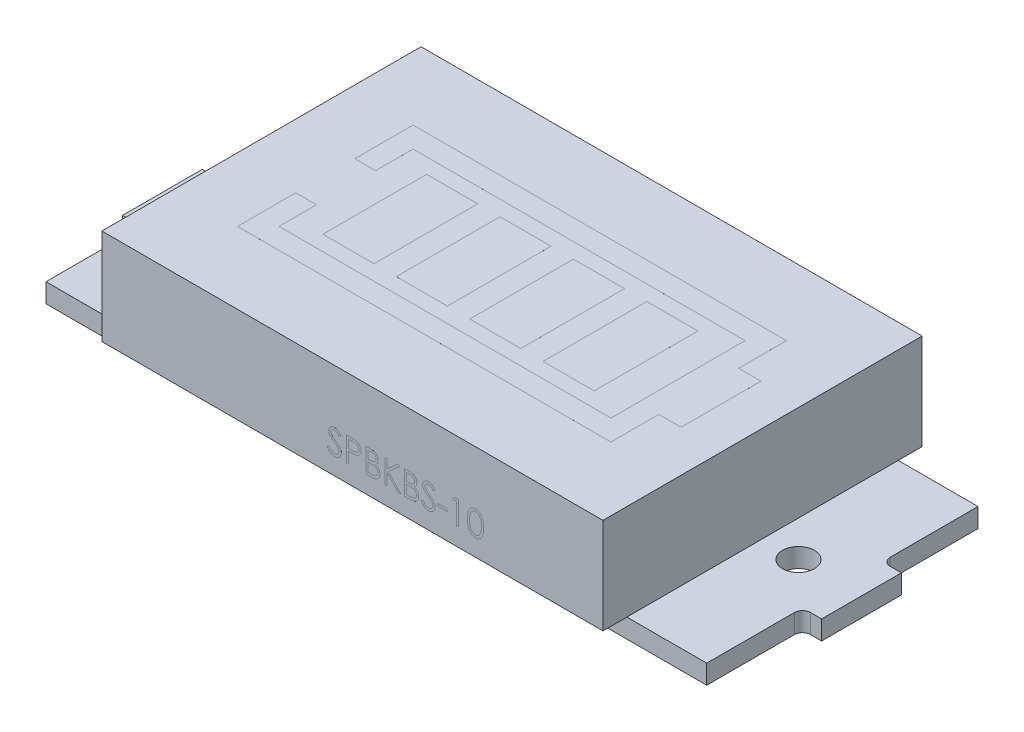
from build123d import *

# Parameters (mm, degrees)
SKETCH1_W               = 41.4
SKETCH1_H               = 17
BOSS_EXTRUDE1_DEPTH     = 0.6
SKETCH2_W               = 1.2
SKETCH2_H               = 5
BOSS_EXTRUDE2_DEPTH     = 0.6
FILLET1_R               = 0.5
CUT_EXTRUDE1_DEPTH      = 24.499361693
CUT_EXTRUDE1_DEPTH_BACK = 24.499361693
SKETCH3_R               = 1
SKETCH6_W               = 0.346153846
SKETCH6_H               = 0.166666667
SKETCH6_W_2             = 0.259615384
SKETCH6_H_2             = 0.125
SKETCH6_W_3             = 0.259615385
SKETCH6_W_4             = 0.134615385
SKETCH6_H_3             = 0.75
BOSS_EXTRUDE5_DEPTH     = 0.0001
CUT_EXTRUDE2_DEPTH      = 24.499364379
CUT_EXTRUDE2_DEPTH_BACK = 24.499364379
SKETCH10_R              = 0.5
SKETCH11_R              = 0.5
BOSS_EXTRUDE9_DEPTH     = 0.0001
SKETCH12_R              = 0.659704282
SKETCH12_R_2            = 0.559704282
SKETCH12_W              = 0.961538461
SKETCH12_H              = 0.256410257
BOSS_EXTRUDE10_DEPTH    = 0.0001
SKETCH4_W               = 31.4
SKETCH4_H               = 20
BOSS_EXTRUDE3_DEPTH     = 6
SKETCH5_W               = 31.4
SKETCH5_H               = 20
BOSS_EXTRUDE4_DEPTH     = 0.0001
BOSS_EXTRUDE6_DEPTH     = 0.0001
SKETCH8_W               = 3.2
SKETCH8_H               = 6.5
BOSS_EXTRUDE7_DEPTH     = 0.0001
SKETCH9_W               = 0.576923077
SKETCH9_H               = 0.153846154
BOSS_EXTRUDE8_DEPTH     = 0.0001


with BuildPart() as part:
    # Sketch1 → Boss-Extrude1 (new, symmetric)
    with BuildSketch(Plane(origin=(0, 0, 0), x_dir=(1, 0, 0), z_dir=(0, 1, 0))):
        Rectangle(SKETCH1_W, SKETCH1_H)
    extrude(amount=BOSS_EXTRUDE1_DEPTH, both=True)

    # Sketch2 → Boss-Extrude2 (add, symmetric)
    with BuildSketch(Plane(origin=(0, 0, 0), x_dir=(1, 0, 0), z_dir=(0, 1, 0))):
        with Locations((-21.3, 0)):
            Rectangle(SKETCH2_W, SKETCH2_H)
        with Locations((21.3, 0)):
            Rectangle(SKETCH2_W, SKETCH2_H)
    extrude(amount=BOSS_EXTRUDE2_DEPTH, both=True)

    # Fillet1
    fillet1_edges = [part.edges().sort_by_distance(p)[0] for p in [
        (-20.7, 0, 2.5),
        (-20.7, 0, -2.5),
        (20.7, 0, -2.5),
        (20.7, 0, 2.5),
    ]]
    fillet(fillet1_edges, radius=FILLET1_R)

    # Sketch3 → Cut-Extrude1 (cut, two sides: drawn at the far end of the back side and taken through both)
    with BuildSketch(Plane(origin=(0, 0, 0), x_dir=(1, 0, 0), z_dir=(0, 1, 0)).offset(-CUT_EXTRUDE1_DEPTH_BACK)):
        with Locations(Location((-17.95, 0, 0), (0, 0, 270))):
            Circle(SKETCH3_R)
        with Locations(Location((17.95, 0, 0), (0, 0, 90))):
            Circle(SKETCH3_R)
    extrude(amount=CUT_EXTRUDE1_DEPTH + CUT_EXTRUDE1_DEPTH_BACK, mode=Mode.SUBTRACT)

    # Sketch6 → Boss-Extrude5 (add)
    # profile 1 of 18: a face of its own
    with BuildSketch(Plane.XZ.offset(0.6)):
        Polygon((9.127563699, -4.203187801), (9.313861776, -4.203187801), (9.54202684, -4.900703827), (9.771794469, -4.203187801), (9.956289661, -4.203187801), (10.125360174, -5.203187801), (9.943669469, -5.203187801), (9.836898635, -4.571577224), (9.628965943, -5.203187801), (9.453885815, -5.203187801), (9.247155045, -4.571577224), (9.140584533, -5.203187801), (8.958693507, -5.203187801), align=None)
    # profile 2 of 18: a face of its own
    with BuildSketch(Plane.XZ.offset(0.6)):
        Polygon((10.29202684, -4.203187801), (10.47151402, -4.203187801), (10.47151402, -4.587803186), (10.817667866, -4.587803186), (10.817667866, -4.203187801), (10.997155045, -4.203187801), (10.997155045, -5.203187801), (10.817667866, -5.203187801), (10.817667866, -4.767290365), (10.47151402, -4.767290365), (10.47151402, -5.203187801), (10.29202684, -5.203187801), align=None)
    # profile 3 of 18: a face of its own
    with BuildSketch(Plane.XZ.offset(0.6)):
        with Locations((11.401001199, -4.837803186)):
            Rectangle(SKETCH6_W, SKETCH6_H)
    # profile 4 of 18: a face of its own
    with BuildSketch(Plane.XZ.offset(0.6)):
        with BuildLine():
            Line((11.804847353, -4.203187801), (12.031009212, -4.203187801))
            add(Edge.make_bspline(
                [(12.031009212, -4.203187801), (12.04864113, -4.203311054), (12.082723828, -4.203549304), (12.132102913, -4.206233805), (12.178019179, -4.210362378), (12.220502224, -4.216041977), (12.259464951, -4.223557643), (12.294857118, -4.232984573), (12.32679751, -4.243866395), (12.355636346, -4.256671067), (12.38196343, -4.271600042), (12.406961836, -4.288229722), (12.430582481, -4.307169301), (12.453156843, -4.328053396), (12.474393596, -4.351264075), (12.494646406, -4.376416886), (12.513419394, -4.403876578), (12.531280026, -4.432984755), (12.547432592, -4.463864776), (12.561521463, -4.496253794), (12.573323795, -4.529943376), (12.582913802, -4.564969424), (12.590558144, -4.601215665), (12.595906736, -4.638755238), (12.599213288, -4.677553389), (12.599548711, -4.703848801), (12.599719148, -4.717210237)],
                knots=[0, 0, 0, 0, 1.44355588, 2.790409838, 4.047694926, 5.217575253, 6.298404546, 7.294384826, 8.214239204, 9.058592145, 9.873746385, 10.689560431, 11.514393297, 12.350027578, 13.205127629, 14.088021785, 14.991911688, 15.926770944, 16.882954281, 17.842803888, 18.816321264, 19.80318086, 20.814351908, 21.847355356, 22.906180909, 24, 24, 24, 24], degree=3))
            add(Edge.make_bspline(
                [(12.599719148, -4.717210237), (12.599272851, -4.736064093), (12.598394289, -4.773179012), (12.590993774, -4.827644727), (12.579024635, -4.879855548), (12.562194938, -4.929403061), (12.541330619, -4.975846038), (12.516405854, -5.018365476), (12.487786098, -5.056733153), (12.455804773, -5.090758029), (12.421176786, -5.120002871), (12.385191325, -5.145048938), (12.347497826, -5.164799852), (12.314284586, -5.177324885), (12.285484563, -5.185114372), (12.260198454, -5.189718034), (12.231476015, -5.193939869), (12.199049433, -5.197202413), (12.163060957, -5.2001118), (12.123367136, -5.201692648), (12.080096488, -5.203006098), (12.050040931, -5.203125646), (12.034414661, -5.203187801)],
                knots=[0, 0, 0, 0, 1.315458931, 2.589557908, 3.828601765, 5.048913369, 6.235739168, 7.376350998, 8.481830359, 9.569842114, 10.627874879, 11.640079404, 12.624025415, 13.590060155, 14.111227486, 14.704434459, 15.382649715, 16.137166398, 16.978595427, 17.902333227, 18.909396075, 20, 20, 20, 20], degree=3))
            Line((12.034414661, -5.203187801), (11.804847353, -5.203187801))
            Line((11.804847353, -5.203187801), (11.804847353, -4.203187801))
        make_face()
        with BuildLine():
            Line((11.984334533, -4.38267498), (11.984334533, -5.023700622))
            Line((11.984334533, -5.023700622), (12.078084533, -5.023700622))
            add(Edge.make_bspline(
                [(12.078084533, -5.023700622), (12.089239343, -5.023680181), (12.110693756, -5.023640868), (12.141669073, -5.021768338), (12.170313387, -5.019888835), (12.196547847, -5.016321475), (12.220563379, -5.012347686), (12.242030074, -5.006817616), (12.261390452, -5.001008745), (12.27840803, -4.993613333), (12.293994745, -4.985289304), (12.308426263, -4.975536739), (12.322356718, -4.964706884), (12.33552567, -4.952481216), (12.347982959, -4.939021628), (12.35965488, -4.924258767), (12.370697224, -4.908237675), (12.380826553, -4.890873645), (12.390082787, -4.872350045), (12.398294105, -4.852846303), (12.405102499, -4.832199995), (12.410761219, -4.810604395), (12.414805016, -4.78787149), (12.418150487, -4.764169657), (12.419875175, -4.739404994), (12.420111878, -4.722554289), (12.420231969, -4.714005109)],
                knots=[0, 0, 0, 0, 1.50275155, 2.890291501, 4.180787663, 5.369391935, 6.45668281, 7.458360028, 8.354766181, 9.177074746, 9.954075863, 10.732690366, 11.5210699, 12.329727389, 13.151100085, 13.990027547, 14.863562427, 15.770965086, 16.696477834, 17.652329173, 18.619756807, 19.62365428, 20.657822005, 21.729286259, 22.847956731, 24, 24, 24, 24], degree=3))
            add(Edge.make_bspline(
                [(12.420231969, -4.714005109), (12.419992789, -4.700904298), (12.419526406, -4.675358733), (12.415028715, -4.638151059), (12.407707332, -4.603114461), (12.397260423, -4.570378967), (12.384091771, -4.539852575), (12.367608134, -4.511793907), (12.348518903, -4.485731617), (12.33342366, -4.470442641), (12.325881007, -4.462803186)],
                knots=[0, 0, 0, 0, 1.13821349, 2.219428113, 3.251817212, 4.244760574, 5.201143372, 6.134805572, 7.068016741, 8, 8, 8, 8], degree=3))
            add(Edge.make_bspline(
                [(12.325881007, -4.462803186), (12.318443237, -4.456293337), (12.303252435, -4.442997708), (12.276582377, -4.427066145), (12.247193355, -4.413068705), (12.214413036, -4.401970296), (12.178558227, -4.393193201), (12.139415376, -4.387139853), (12.097194101, -4.383250036), (12.067944186, -4.382870772), (12.052844148, -4.38267498)],
                knots=[0, 0, 0, 0, 0.813307809, 1.661089106, 2.549956539, 3.493439533, 4.508053171, 5.589449661, 6.755572447, 8, 8, 8, 8], degree=3))
            Line((12.052844148, -4.38267498), (11.984334533, -4.38267498))
        make_face(mode=Mode.SUBTRACT)
    # profile 5 of 18: a face of its own
    with BuildSketch(Plane.XZ.offset(0.6)):
        Polygon((12.779206327, -4.203187801), (12.958693507, -4.203187801), (12.958693507, -5.023700622), (13.240744789, -5.023700622), (13.240744789, -5.203187801), (12.779206327, -5.203187801), align=None)
    # profile 6 of 18: a face of its own
    with BuildSketch(Plane.XZ.offset(0.6)):
        Polygon((13.501762417, -4.203187801), (13.779206327, -4.203187801), (13.779206327, -5.203187801), (13.599719148, -5.203187801), (13.599719148, -4.369854468), (13.394590943, -4.369854468), align=None)
    # profile 7 of 18: a face of its own
    with BuildSketch(Plane.XZ.offset(0.6)):
        with BuildLine():
            add(Edge.make_bspline(
                [(14.629366584, -4.664726263), (14.639852843, -4.672218978), (14.660609448, -4.687050133), (14.68802133, -4.713620702), (14.711632517, -4.743260479), (14.731195066, -4.77578766), (14.74686799, -4.81040272), (14.758087426, -4.846735663), (14.765213883, -4.884466026), (14.765992305, -4.910153909), (14.766385815, -4.923139724)],
                knots=[0, 0, 0, 0, 1.013736912, 2.006600758, 2.994453809, 3.989973287, 4.987781207, 5.978959008, 6.978317308, 8, 8, 8, 8], degree=3))
            add(Edge.make_bspline(
                [(14.766385815, -4.923139724), (14.765911075, -4.937201077), (14.764969489, -4.965089964), (14.756644611, -5.005989014), (14.743279354, -5.045281206), (14.725013123, -5.082532853), (14.702110628, -5.116586316), (14.67541564, -5.146733336), (14.644894507, -5.172186571), (14.616478469, -5.189456426), (14.592019792, -5.200928465), (14.572281854, -5.208270339), (14.551439889, -5.214733832), (14.529345172, -5.219897735), (14.50600172, -5.223929008), (14.481442847, -5.226591253), (14.455652387, -5.228526543), (14.438064383, -5.228726366), (14.429046071, -5.228828827)],
                knots=[0, 0, 0, 0, 1.313679292, 2.605514271, 3.884962679, 5.186178731, 6.472827995, 7.711026938, 8.938935107, 10.174644318, 10.808706728, 11.462743532, 12.142127587, 12.847854939, 13.582806024, 14.355735269, 15.156897313, 16, 16, 16, 16], degree=3))
            add(Edge.make_bspline(
                [(14.429046071, -5.228828827), (14.419428936, -5.228698374), (14.400648566, -5.228443627), (14.37323341, -5.226903288), (14.347372819, -5.2240635), (14.323012546, -5.22032514), (14.300176028, -5.215378206), (14.278862588, -5.209105764), (14.259020764, -5.201963892), (14.234733328, -5.191089778), (14.206977194, -5.17410752), (14.176977832, -5.149237493), (14.150646067, -5.119616514), (14.127753092, -5.086076039), (14.109707986, -5.04882241), (14.096289107, -5.009024896), (14.088342288, -4.966791344), (14.08738558, -4.937863437), (14.086898635, -4.923139724)],
                knots=[0, 0, 0, 0, 0.886964665, 1.7320671, 2.531131818, 3.285397207, 4.004107883, 4.684213108, 5.332925796, 5.947568694, 7.135706876, 8.320776993, 9.52873045, 10.778999824, 12.05415135, 13.333578234, 14.642845846, 16, 16, 16, 16], degree=3))
            add(Edge.make_bspline(
                [(14.086898635, -4.923139724), (14.087343621, -4.910295707), (14.088218073, -4.885055657), (14.094481886, -4.848071002), (14.105222423, -4.813005173), (14.119960111, -4.779614056), (14.138964109, -4.747893935), (14.162346797, -4.718078209), (14.189811705, -4.689897897), (14.210638857, -4.673255983), (14.221313699, -4.664726263)],
                knots=[0, 0, 0, 0, 1.01821053, 2.000906977, 2.963938143, 3.919209931, 4.888045165, 5.887808425, 6.917407893, 8, 8, 8, 8], degree=3))
            add(Edge.make_bspline(
                [(14.221313699, -4.664726263), (14.214695863, -4.657093557), (14.201667338, -4.642067059), (14.184808298, -4.617883108), (14.170605266, -4.592949429), (14.158546216, -4.567468372), (14.149631859, -4.541001217), (14.14289055, -4.513964081), (14.139077672, -4.486081519), (14.138481708, -4.467287844), (14.138180686, -4.457795173)],
                knots=[0, 0, 0, 0, 1.061529281, 2.089831458, 3.092927091, 4.075998741, 5.048384512, 6.024008542, 7.00192825, 8, 8, 8, 8], degree=3))
            add(Edge.make_bspline(
                [(14.138180686, -4.457795173), (14.138579795, -4.444944895), (14.13936722, -4.419591792), (14.146341398, -4.382519569), (14.157920228, -4.347293568), (14.173672241, -4.314016927), (14.193674849, -4.283414872), (14.217442277, -4.255971671), (14.24530865, -4.232692555), (14.276237691, -4.212718047), (14.310384432, -4.196830508), (14.347424891, -4.185713598), (14.386911801, -4.178676008), (14.414125, -4.177928912), (14.428044469, -4.177546775)],
                knots=[0, 0, 0, 0, 1.022455555, 2.017265428, 2.990720743, 3.968117071, 4.939886797, 5.893155559, 6.847550415, 7.820889576, 8.817530429, 9.83499769, 10.892607882, 12, 12, 12, 12], degree=3))
            add(Edge.make_bspline(
                [(14.428044469, -4.177546775), (14.441763461, -4.177929538), (14.468512623, -4.178675845), (14.507305602, -4.185666803), (14.54354561, -4.197031344), (14.576932968, -4.21325434), (14.607542143, -4.233267347), (14.634934906, -4.25735702), (14.658627751, -4.285483739), (14.678796394, -4.316877459), (14.694867702, -4.350699644), (14.706749164, -4.386169227), (14.713621542, -4.423007413), (14.714607714, -4.448018803), (14.715103763, -4.46059966)],
                knots=[0, 0, 0, 0, 1.094655142, 2.134348324, 3.136019022, 4.118575226, 5.088726318, 6.048298823, 7.020513804, 8.015920439, 9.020015034, 10.003048569, 10.995523219, 12, 12, 12, 12], degree=3))
            add(Edge.make_bspline(
                [(14.715103763, -4.46059966), (14.714864804, -4.469491129), (14.714395865, -4.486939973), (14.710928623, -4.512647045), (14.705090213, -4.537313015), (14.696950148, -4.561533957), (14.685632678, -4.585968092), (14.670317511, -4.611083619), (14.65168862, -4.637924096), (14.637058422, -4.655490639), (14.629366584, -4.664726263)],
                knots=[0, 0, 0, 0, 0.940746401, 1.846144481, 2.739104268, 3.619506754, 4.545839139, 5.581956076, 6.728711598, 8, 8, 8, 8], degree=3))
        make_face()
        with BuildLine():
            add(Edge.make_bspline(
                [(14.423637417, -4.357033955), (14.416247555, -4.357390215), (14.401872641, -4.358083219), (14.381361322, -4.364338346), (14.362920976, -4.374569052), (14.346972542, -4.388648517), (14.333893995, -4.405731839), (14.324281981, -4.425372608), (14.318581943, -4.447328436), (14.317978483, -4.462702323), (14.317667866, -4.470615686)],
                knots=[0, 0, 0, 0, 1.018099191, 1.980427864, 2.929421084, 3.909248076, 4.895556904, 5.880788387, 6.909183412, 8, 8, 8, 8], degree=3))
            add(Edge.make_bspline(
                [(14.317667866, -4.470615686), (14.318051573, -4.47859663), (14.318800799, -4.494180194), (14.324692618, -4.516557864), (14.334735387, -4.536838398), (14.348524041, -4.5545982), (14.365279488, -4.569103893), (14.384040452, -4.580182534), (14.405014996, -4.586507042), (14.419590292, -4.587364668), (14.427042866, -4.587803186)],
                knots=[0, 0, 0, 0, 1.07118507, 2.091592095, 3.082435519, 4.092579768, 5.090825648, 6.043203473, 6.999459622, 8, 8, 8, 8], degree=3))
            add(Edge.make_bspline(
                [(14.427042866, -4.587803186), (14.434636335, -4.58746341), (14.449429837, -4.586801463), (14.470456752, -4.580312851), (14.489399315, -4.569935638), (14.505620822, -4.555264555), (14.519057212, -4.537498321), (14.528842625, -4.516863368), (14.534474756, -4.493747399), (14.535226665, -4.477591459), (14.535616584, -4.469213442)],
                knots=[0, 0, 0, 0, 1.008803858, 1.965339183, 2.900766489, 3.864508618, 4.855158575, 5.849593072, 6.884859315, 8, 8, 8, 8], degree=3))
            add(Edge.make_bspline(
                [(14.535616584, -4.469213442), (14.535216801, -4.46130531), (14.534443636, -4.446011262), (14.528899746, -4.42405401), (14.518718115, -4.404719786), (14.505340765, -4.387742548), (14.488569153, -4.374051462), (14.46909854, -4.363982955), (14.4470723, -4.358143123), (14.431618206, -4.357411684), (14.423637417, -4.357033955)],
                knots=[0, 0, 0, 0, 1.065910571, 2.061433587, 3.023559535, 3.990682701, 4.956464619, 5.918590567, 6.925120432, 8, 8, 8, 8], degree=3))
        make_face(mode=Mode.SUBTRACT)
        with BuildLine():
            add(Edge.make_bspline(
                [(14.429446712, -4.767290365), (14.423830976, -4.767383623), (14.412762431, -4.767567432), (14.396490761, -4.769687034), (14.380876421, -4.772845764), (14.365938783, -4.777203143), (14.351753312, -4.783143347), (14.338199761, -4.790304373), (14.32532494, -4.79875861), (14.313319816, -4.80835257), (14.30246999, -4.818882856), (14.292689859, -4.829865603), (14.284695982, -4.841584744), (14.278038989, -4.853650732), (14.272690057, -4.866159183), (14.269154009, -4.879316086), (14.266877289, -4.892946227), (14.266550603, -4.902230526), (14.266385815, -4.906913763)],
                knots=[0, 0, 0, 0, 1.129580664, 2.226389355, 3.296443603, 4.333934503, 5.352185725, 6.386189251, 7.41493955, 8.447544828, 9.47401038, 10.455044306, 11.4018853, 12.322125673, 13.225630306, 14.132028716, 15.057747923, 16, 16, 16, 16], degree=3))
            add(Edge.make_bspline(
                [(14.266385815, -4.906913763), (14.266464356, -4.911797915), (14.266620132, -4.921485028), (14.268972919, -4.935624152), (14.272360516, -4.949260365), (14.277118504, -4.962266026), (14.283481409, -4.974633561), (14.291078833, -4.986483211), (14.300175696, -4.997731884), (14.310525338, -5.008319267), (14.322111716, -5.017870977), (14.334599293, -5.0262862), (14.347823136, -5.033705491), (14.362180215, -5.039049158), (14.377138831, -5.043940152), (14.393099729, -5.0469074), (14.409888581, -5.049090784), (14.421359175, -5.049256593), (14.427243186, -5.049341647)],
                knots=[0, 0, 0, 0, 0.973817353, 1.931446211, 2.852767904, 3.776304432, 4.688323523, 5.623710549, 6.581246645, 7.570897993, 8.57436511, 9.572506873, 10.574556662, 11.591826551, 12.624694332, 13.712108235, 14.826391851, 16, 16, 16, 16], degree=3))
            add(Edge.make_bspline(
                [(14.427243186, -5.049341647), (14.433191047, -5.049233835), (14.444781544, -5.049023744), (14.46172452, -5.047166933), (14.477749568, -5.044220714), (14.492837547, -5.040006934), (14.507045513, -5.034608915), (14.520182878, -5.027738305), (14.53254959, -5.019951991), (14.543748243, -5.010855249), (14.553973439, -5.000941698), (14.56278388, -4.990077289), (14.570275301, -4.978611383), (14.576317949, -4.96642009), (14.581193822, -4.953560958), (14.584538366, -4.939905767), (14.586613775, -4.925607972), (14.586802662, -4.915868669), (14.586898635, -4.910920173)],
                knots=[0, 0, 0, 0, 1.200705402, 2.339794563, 3.437264955, 4.487414319, 5.499029866, 6.500076882, 7.476298407, 8.444948224, 9.407950986, 10.347155707, 11.263432813, 12.167927724, 13.089546445, 14.03463663, 15.00140776, 16, 16, 16, 16], degree=3))
            add(Edge.make_bspline(
                [(14.586898635, -4.910920173), (14.586715384, -4.905906982), (14.586357191, -4.896107933), (14.584397213, -4.881637331), (14.580720495, -4.867918974), (14.575910273, -4.8546347), (14.569511574, -4.842059403), (14.561567727, -4.830219624), (14.552525679, -4.818822077), (14.541957523, -4.808374141), (14.530402889, -4.798821013), (14.518104821, -4.790310225), (14.505101201, -4.783102373), (14.491356459, -4.777210312), (14.476820375, -4.772843496), (14.46160386, -4.769687145), (14.445731874, -4.767566958), (14.434929095, -4.76738348), (14.429446712, -4.767290365)],
                knots=[0, 0, 0, 0, 1.011708178, 1.977538892, 2.938094892, 3.871441737, 4.823268678, 5.775953079, 6.743660653, 7.753304209, 8.767430709, 9.76505158, 10.765940967, 11.761741361, 12.775867861, 13.822051386, 14.89469657, 16, 16, 16, 16], degree=3))
        make_face(mode=Mode.SUBTRACT)
    # profile 8 of 18: a face of its own
    with BuildSketch(Plane.XZ.offset(0.6)):
        with BuildLine():
            Line((15.445872994, -4.336801583), (15.311658251, -4.459598057))
            add(Edge.make_bspline(
                [(15.311658251, -4.459598057), (15.305909066, -4.451488236), (15.294871435, -4.435918508), (15.276980585, -4.415070277), (15.259170521, -4.397285184), (15.241276245, -4.382637527), (15.223139147, -4.371216303), (15.204790712, -4.363129949), (15.186334961, -4.357989378), (15.173935546, -4.357349253), (15.167828122, -4.357033955)],
                knots=[0, 0, 0, 0, 1.299362458, 2.494594718, 3.587462134, 4.587049575, 5.512617175, 6.380583204, 7.202344345, 8, 8, 8, 8], degree=3))
            add(Edge.make_bspline(
                [(15.167828122, -4.357033955), (15.162131293, -4.357233742), (15.151132212, -4.357619479), (15.135452207, -4.361453676), (15.121531275, -4.368070937), (15.109383002, -4.376723562), (15.099759778, -4.387147969), (15.092076379, -4.398080492), (15.087749981, -4.410147524), (15.087180541, -4.418435649), (15.086898635, -4.422538763)],
                knots=[0, 0, 0, 0, 1.185010067, 2.2879431, 3.333075148, 4.379039566, 5.372662701, 6.27520591, 7.14612461, 8, 8, 8, 8], degree=3))
            add(Edge.make_bspline(
                [(15.086898635, -4.422538763), (15.087075292, -4.426701045), (15.087431053, -4.435083303), (15.090867222, -4.447368545), (15.096046511, -4.459372658), (15.100995533, -4.466680132), (15.103525238, -4.470415365)],
                knots=[0, 0, 0, 0, 0.967525499, 1.948461899, 2.951351359, 4, 4, 4, 4], degree=3))
            add(Edge.make_bspline(
                [(15.103525238, -4.470415365), (15.105825013, -4.473318723), (15.111118791, -4.480001869), (15.121212942, -4.49058693), (15.133889076, -4.503554556), (15.149634997, -4.518458829), (15.167797049, -4.535835765), (15.189217066, -4.555002269), (15.213278486, -4.576551906), (15.230380786, -4.591558294), (15.239342545, -4.599421775)],
                knots=[0, 0, 0, 0, 0.473873513, 1.090794244, 1.870441696, 2.795289791, 3.865433203, 5.087734844, 6.473946851, 8, 8, 8, 8], degree=3))
            add(Edge.make_bspline(
                [(15.239342545, -4.599421775), (15.247754446, -4.606701851), (15.263718484, -4.620517921), (15.286432141, -4.640127615), (15.306393663, -4.657769978), (15.323893843, -4.673180236), (15.338667396, -4.686520079), (15.350776429, -4.697853271), (15.360368835, -4.706959175), (15.365821556, -4.712459146), (15.368148635, -4.714806391)],
                knots=[0, 0, 0, 0, 1.543621617, 2.929473131, 4.163658386, 5.240097082, 6.164993805, 6.925417477, 7.541396219, 8, 8, 8, 8], degree=3))
            add(Edge.make_bspline(
                [(15.368148635, -4.714806391), (15.376977088, -4.724360667), (15.393948474, -4.742727342), (15.416005294, -4.771189912), (15.43415877, -4.798975184), (15.448202643, -4.826605983), (15.458809141, -4.854480966), (15.466286863, -4.883283766), (15.47076532, -4.913315354), (15.471262534, -4.933808247), (15.47151402, -4.944173378)],
                knots=[0, 0, 0, 0, 1.206664779, 2.319633467, 3.337109185, 4.282041471, 5.190008762, 6.099243693, 7.03861361, 8, 8, 8, 8], degree=3))
            add(Edge.make_bspline(
                [(15.47151402, -4.944173378), (15.471335018, -4.954272927), (15.470983811, -4.974088618), (15.466682191, -5.00308593), (15.460548335, -5.030837616), (15.451064316, -5.057041699), (15.439505251, -5.08212831), (15.425014292, -5.10570668), (15.407996649, -5.128015432), (15.388491817, -5.148655769), (15.366917156, -5.167385444), (15.343776282, -5.184059044), (15.318842912, -5.197825224), (15.292330072, -5.209160691), (15.264251954, -5.21789142), (15.234642008, -5.224344242), (15.203454943, -5.228217124), (15.182128779, -5.228621988), (15.171233571, -5.228828827)],
                knots=[0, 0, 0, 0, 1.043214005, 2.046824704, 3.02475056, 3.976699089, 4.921714032, 5.875962561, 6.831408892, 7.817874052, 8.806269674, 9.781291748, 10.760897367, 11.74438705, 12.757449933, 13.795994037, 14.874007457, 16, 16, 16, 16], degree=3))
            add(Edge.make_bspline(
                [(15.171233571, -5.228828827), (15.162680926, -5.228677097), (15.145741784, -5.228376585), (15.120776049, -5.225923158), (15.09666881, -5.221963587), (15.073447221, -5.216288338), (15.051006665, -5.209097029), (15.029346221, -5.20031312), (15.008615417, -5.189800464), (14.988657394, -5.177775244), (14.969569174, -5.163812379), (14.951109392, -5.148197336), (14.93346141, -5.130689948), (14.916540467, -5.111331619), (14.900454829, -5.090067532), (14.884677954, -5.067193829), (14.869911015, -5.042286004), (14.860788819, -5.024812963), (14.856129404, -5.015888122)],
                knots=[0, 0, 0, 0, 1.016823716, 2.013894106, 2.979844003, 3.91962641, 4.853723003, 5.779685073, 6.695824784, 7.614987388, 8.547259901, 9.504950863, 10.487499108, 11.500346958, 12.559593716, 13.656357062, 14.802919212, 16, 16, 16, 16], degree=3))
            Line((14.856129404, -5.015888122), (15.013981969, -4.921136519))
            add(Edge.make_bspline(
                [(15.013981969, -4.921136519), (15.0198102, -4.93126738), (15.030983418, -4.950689107), (15.049917481, -4.976784658), (15.069314461, -4.999131178), (15.089622801, -5.01733369), (15.110595557, -5.031635586), (15.132334033, -5.041856714), (15.154853503, -5.04818358), (15.170192743, -5.048956236), (15.177844148, -5.049341647)],
                knots=[0, 0, 0, 0, 1.283663364, 2.460892379, 3.537111102, 4.529833553, 5.449777664, 6.316464042, 7.160231139, 8, 8, 8, 8], degree=3))
            add(Edge.make_bspline(
                [(15.177844148, -5.049341647), (15.185626723, -5.0490269), (15.200726051, -5.048416244), (15.222278409, -5.042775802), (15.242038428, -5.033919894), (15.259118842, -5.021283735), (15.27358146, -5.006699687), (15.284255702, -4.990474266), (15.290961332, -4.972918753), (15.29167028, -4.960723539), (15.29202684, -4.954590045)],
                knots=[0, 0, 0, 0, 1.13588714, 2.203786484, 3.234766741, 4.283437687, 5.291419208, 6.222934724, 7.106237994, 8, 8, 8, 8], degree=3))
            add(Edge.make_bspline(
                [(15.29202684, -4.954590045), (15.291697572, -4.948883827), (15.291028694, -4.937292191), (15.286101947, -4.920057292), (15.278399938, -4.902830232), (15.269287918, -4.888700131), (15.260015297, -4.87686938), (15.25114858, -4.86661857), (15.240351264, -4.85529322), (15.227650727, -4.842879082), (15.213214775, -4.829266873), (15.197031248, -4.814457925), (15.178914829, -4.798582687), (15.166110107, -4.787768632), (15.159414661, -4.782114083)],
                knots=[0, 0, 0, 0, 0.916159276, 1.861089862, 2.860218735, 3.940849679, 4.552606315, 5.27541173, 6.11797699, 7.06649574, 8.129236253, 9.306560635, 10.591630461, 12, 12, 12, 12], degree=3))
            add(Edge.make_bspline(
                [(15.159414661, -4.782114083), (15.14668635, -4.771344712), (15.12225687, -4.750675029), (15.087734915, -4.720146558), (15.056627543, -4.691614905), (15.029203429, -4.664727355), (15.00511315, -4.639980461), (14.984519853, -4.617173217), (14.967649767, -4.596129697), (14.949897639, -4.571205056), (14.933029568, -4.540832669), (14.918450767, -4.504291166), (14.908992657, -4.4677543), (14.907933008, -4.44322546), (14.907411456, -4.431152545)],
                knots=[0, 0, 0, 0, 1.345494975, 2.582412109, 3.71882943, 4.751509156, 5.681369928, 6.505683931, 7.230279997, 7.856715994, 8.973648664, 10.023341002, 11.027102913, 12, 12, 12, 12], degree=3))
            add(Edge.make_bspline(
                [(14.907411456, -4.431152545), (14.907628368, -4.422591081), (14.90805571, -4.405724078), (14.91186766, -4.380923608), (14.917564766, -4.356993238), (14.925838599, -4.334020278), (14.936577035, -4.312033501), (14.949618448, -4.290925273), (14.965165347, -4.27088987), (14.982685653, -4.251940573), (15.001988544, -4.234623073), (15.022616136, -4.219338643), (15.044451676, -4.206429192), (15.067361583, -4.195719864), (15.091487823, -4.187522555), (15.116652657, -4.181711893), (15.142892179, -4.178255897), (15.160739736, -4.177786094), (15.169831327, -4.177546775)],
                knots=[0, 0, 0, 0, 1.010766082, 1.991317756, 2.957454644, 3.913069143, 4.869106762, 5.843196583, 6.838735724, 7.860187025, 8.887984031, 9.89767229, 10.887916223, 11.879572884, 12.879850636, 13.892031539, 14.926195476, 16, 16, 16, 16], degree=3))
            add(Edge.make_bspline(
                [(15.169831327, -4.177546775), (15.18161358, -4.177977795), (15.205085079, -4.178836433), (15.239788368, -4.185550697), (15.273685089, -4.196109585), (15.300999703, -4.208847721), (15.322733431, -4.22118716), (15.339390303, -4.232547761), (15.356339568, -4.24556194), (15.373717909, -4.260270708), (15.391202411, -4.276951198), (15.409290242, -4.295206318), (15.427734932, -4.315193833), (15.439721057, -4.329472822), (15.445872994, -4.336801583)],
                knots=[0, 0, 0, 0, 1.282922637, 2.555718331, 3.837320111, 5.142675274, 5.830281639, 6.55870424, 7.337177975, 8.157850921, 9.037902056, 9.96903443, 10.957596896, 12, 12, 12, 12], degree=3))
        make_face()
    # profile 9 of 18: a face of its own
    with BuildSketch(Plane.XZ.offset(0.6)):
        Polygon((7.402675643, -5.956085301), (7.542399201, -5.956085301), (7.713522999, -6.47922232), (7.88584872, -5.956085301), (8.024220114, -5.956085301), (8.151022999, -6.706085301), (8.01475497, -6.706085301), (7.934676845, -6.232377368), (7.778727326, -6.706085301), (7.647417229, -6.706085301), (7.492369152, -6.232377368), (7.412441268, -6.706085301), (7.276022999, -6.706085301), align=None)
    # profile 10 of 18: a face of its own
    with BuildSketch(Plane.XZ.offset(0.6)):
        Polygon((8.276022999, -5.956085301), (8.410638383, -5.956085301), (8.410638383, -6.244546839), (8.670253768, -6.244546839), (8.670253768, -5.956085301), (8.804869152, -5.956085301), (8.804869152, -6.706085301), (8.670253768, -6.706085301), (8.670253768, -6.379162224), (8.410638383, -6.379162224), (8.410638383, -6.706085301), (8.276022999, -6.706085301), align=None)
    # profile 11 of 18: a face of its own
    with BuildSketch(Plane.XZ.offset(0.6)):
        with Locations((9.107753768, -6.432046839)):
            Rectangle(SKETCH6_W_2, SKETCH6_H_2)
    # profile 12 of 18: a face of its own
    with BuildSketch(Plane.XZ.offset(0.6)):
        Polygon((9.410638383, -5.956085301), (9.814484537, -5.956085301), (9.814484537, -6.090700686), (9.545253768, -6.090700686), (9.545253768, -6.234931455), (9.814484537, -6.234931455), (9.814484537, -6.369546839), (9.545253768, -6.369546839), (9.545253768, -6.571469916), (9.814484537, -6.571469916), (9.814484537, -6.706085301), (9.410638383, -6.706085301), align=None)
    # profile 13 of 18: a face of its own
    with BuildSketch(Plane.XZ.offset(0.6)):
        Polygon((9.872176845, -5.956085301), (10.276022999, -5.956085301), (10.276022999, -6.090700686), (10.141407614, -6.090700686), (10.141407614, -6.706085301), (10.006792229, -6.706085301), (10.006792229, -6.090700686), (9.872176845, -6.090700686), align=None)
    # profile 14 of 18: a face of its own
    with BuildSketch(Plane.XZ.offset(0.6)):
        with Locations((10.511599922, -6.432046839)):
            Rectangle(SKETCH6_W_3, SKETCH6_H_2)
    # profile 15 of 18: a face of its own
    with BuildSketch(Plane.XZ.offset(0.6)):
        Polygon((10.814484537, -5.956085301), (10.949099922, -5.956085301), (10.949099922, -6.571469916), (11.160638383, -6.571469916), (11.160638383, -6.706085301), (10.814484537, -6.706085301), align=None)
    # profile 16 of 18: a face of its own
    with BuildSketch(Plane.XZ.offset(0.6)):
        with Locations((11.324099922, -6.331085301)):
            Rectangle(SKETCH6_W_4, SKETCH6_H_3)
    # profile 17 of 18: a face of its own
    with BuildSketch(Plane.XZ.offset(0.6)):
        Polygon((11.501984537, -5.956085301), (11.645764585, -5.956085301), (11.838522999, -6.488837705), (12.031732133, -5.956085301), (12.17506146, -5.956085301), (11.903126364, -6.706085301), (11.773468912, -6.706085301), align=None)
    # profile 18 of 18: a face of its own
    with BuildSketch(Plane.XZ.offset(0.6)):
        Polygon((12.295253768, -5.956085301), (12.699099922, -5.956085301), (12.699099922, -6.090700686), (12.429869152, -6.090700686), (12.429869152, -6.234931455), (12.699099922, -6.234931455), (12.699099922, -6.369546839), (12.429869152, -6.369546839), (12.429869152, -6.571469916), (12.699099922, -6.571469916), (12.699099922, -6.706085301), (12.295253768, -6.706085301), align=None)
    extrude(amount=BOSS_EXTRUDE5_DEPTH)

    # Sketch10 → Cut-Extrude2 (cut, two sides: drawn at the far end of the back side and taken through both)
    with BuildSketch(Plane(origin=(0, 0, 0), x_dir=(1, 0, 0), z_dir=(0, 1, 0)).offset(-CUT_EXTRUDE2_DEPTH_BACK)):
        with Locations(Location((-19.2, 7, 0), (0, 0, 270))):
            Circle(SKETCH10_R)
        with Locations(Location((-19.2, 4.4, 0), (0, 0, 270))):
            Circle(SKETCH10_R)
    extrude(amount=CUT_EXTRUDE2_DEPTH + CUT_EXTRUDE2_DEPTH_BACK, mode=Mode.SUBTRACT)

    # Sketch11 → Boss-Extrude9 (add)
    # profile 1 of 2: a face of its own
    with BuildSketch(Plane(origin=(0, 0.6, 0), x_dir=(1, 0, 0), z_dir=(0, 1, 0))):
        with BuildLine():
            Line((-19.25, 7.6), (-19.15, 7.6))
            ThreePointArc((-19.15, 7.6), (-18.55, 7), (-19.15, 6.4))
            Line((-19.15, 6.4), (-19.25, 6.4))
            ThreePointArc((-19.25, 6.4), (-19.85, 7), (-19.25, 7.6))
        make_face()
        with Locations(Location((-19.2, 7, 0), (0, 0, 270))):
            Circle(SKETCH11_R, mode=Mode.SUBTRACT)
    # profile 2 of 2: a face of its own
    with BuildSketch(Plane(origin=(0, 0.6, 0), x_dir=(1, 0, 0), z_dir=(0, 1, 0))):
        with BuildLine():
            Line((-19.25, 5), (-19.15, 5))
            ThreePointArc((-19.15, 5), (-18.55, 4.4), (-19.15, 3.8))
            Line((-19.15, 3.8), (-19.25, 3.8))
            ThreePointArc((-19.25, 3.8), (-19.85, 4.4), (-19.25, 5))
        make_face()
        with Locations(Location((-19.2, 4.4, 0), (0, 0, 270))):
            Circle(SKETCH11_R, mode=Mode.SUBTRACT)
    boss_extrude9 = extrude(amount=BOSS_EXTRUDE9_DEPTH)

    # Mirror1: Boss-Extrude9 across plane
    add(boss_extrude9.mirror(Plane.ZX))

    # Sketch12 → Boss-Extrude10 (add)
    # profile 1 of 4: a face of its own
    with BuildSketch(Plane(origin=(0, 0.6, 0), x_dir=(1, 0, 0), z_dir=(0, 1, 0))):
        with Locations(Location((-17.126098594, 7.011696376, 0), (0, 0, 270))):
            Circle(SKETCH12_R)
        with Locations(Location((-17.126098594, 7.011696376, 0), (0, 0, 270))):
            Circle(SKETCH12_R_2, mode=Mode.SUBTRACT)
    # profile 2 of 4: a face of its own
    with BuildSketch(Plane(origin=(0, 0.6, 0), x_dir=(1, 0, 0), z_dir=(0, 1, 0))):
        with Locations((-17.126098594, 7.011696376)):
            Rectangle(SKETCH12_W, SKETCH12_H)
    # profile 3 of 4: a face of its own
    with BuildSketch(Plane(origin=(0, 0.6, 0), x_dir=(1, 0, 0), z_dir=(0, 1, 0))):
        with Locations(Location((-17.135831485, 4.408731577, 0), (0, 0, 270))):
            Circle(SKETCH12_R)
        with Locations(Location((-17.135831485, 4.408731577, 0), (0, 0, 270))):
            Circle(SKETCH12_R_2, mode=Mode.SUBTRACT)
    # profile 4 of 4: a face of its own
    with BuildSketch(Plane(origin=(0, 0.6, 0), x_dir=(1, 0, 0), z_dir=(0, 1, 0))):
        Polygon((-17.645446869, 4.47603927), (-17.203139177, 4.47603927), (-17.203139177, 4.918346962), (-17.068523792, 4.918346962), (-17.068523792, 4.47603927), (-16.6262161, 4.47603927), (-16.6262161, 4.341423885), (-17.068523792, 4.341423885), (-17.068523792, 3.899116193), (-17.203139177, 3.899116193), (-17.203139177, 4.341423885), (-17.645446869, 4.341423885), align=None)
    extrude(amount=BOSS_EXTRUDE10_DEPTH)

    # Sketch4 → Boss-Extrude3 (add)
    with BuildSketch(Plane(origin=(0, 0.6, 0), x_dir=(1, 0, 0), z_dir=(0, 1, 0))):
        Rectangle(SKETCH4_W, SKETCH4_H)
    extrude(amount=BOSS_EXTRUDE3_DEPTH)

    # Sketch5 → Boss-Extrude4 (add)
    with BuildSketch(Plane(origin=(0, 6.6, 0), x_dir=(1, 0, 0), z_dir=(0, 1, 0))):
        Rectangle(SKETCH5_W, SKETCH5_H)
    extrude(amount=BOSS_EXTRUDE4_DEPTH)

    # Sketch7 → Boss-Extrude6 (add)
    with BuildSketch(Plane(origin=(0, 6.6001, 0), x_dir=(1, 0, 0), z_dir=(0, 1, 0))):
        Polygon((10.4, 4.2), (10.4, -4.2), (-10.4, -4.2), (-10.4, -1.85), (-11.7, -1.85), (-11.7, -5.5), (11.7, -5.5), (11.7, -2.5), (13.1, -2.5), (13.1, 2.5), (11.7, 2.5), (11.7, 5.5), (-11.7, 5.5), (-11.7, 1.85), (-10.4, 1.85), (-10.4, 4.2), align=None)
    extrude(amount=BOSS_EXTRUDE6_DEPTH)

    # Sketch8 → Boss-Extrude7 (add)
    with BuildSketch(Plane(origin=(0, 6.6001, 0), x_dir=(1, 0, 0), z_dir=(0, 1, 0))):
        with Locations((-7, 0)):
            Rectangle(SKETCH8_W, SKETCH8_H)
        with Locations((-2.4, 0)):
            Rectangle(SKETCH8_W, SKETCH8_H)
        with Locations((2.2, 0)):
            Rectangle(SKETCH8_W, SKETCH8_H)
        with Locations((6.8, 0)):
            Rectangle(SKETCH8_W, SKETCH8_H)
    extrude(amount=BOSS_EXTRUDE7_DEPTH)

    # Sketch9 → Boss-Extrude8 (add)
    # profile 1 of 9: a face of its own
    with BuildSketch(Plane.XY.offset(10)):
        with BuildLine():
            Line((-1.57808078, 1.982032747), (-1.451277896, 2.058054382))
            add(Edge.make_bspline(
                [(-1.451277896, 2.058054382), (-1.439484366, 2.038312502), (-1.416888417, 2.000487823), (-1.379194977, 1.949377235), (-1.340138015, 1.90593631), (-1.299428301, 1.870417764), (-1.257314323, 1.842453956), (-1.213521157, 1.822652999), (-1.168196381, 1.810303296), (-1.137350458, 1.808803258), (-1.121950973, 1.808054382)],
                knots=[0, 0, 0, 0, 1.272034388, 2.437168799, 3.508375237, 4.49857839, 5.41946034, 6.295179144, 7.148887113, 8, 8, 8, 8], degree=3))
            add(Edge.make_bspline(
                [(-1.121950973, 1.808054382), (-1.108799461, 1.80842067), (-1.082726558, 1.809146837), (-1.04434274, 1.816124324), (-1.007064825, 1.826843807), (-0.971661123, 1.842195635), (-0.938620145, 1.860769272), (-0.909645847, 1.883203348), (-0.884597513, 1.908320293), (-0.864107892, 1.936341431), (-0.848387877, 1.966477352), (-0.836305562, 1.997409902), (-0.829600531, 2.029625003), (-0.828590493, 2.051315202), (-0.82808078, 2.062261112)],
                knots=[0, 0, 0, 0, 1.095163259, 2.171163733, 3.241058638, 4.321873601, 5.38011039, 6.391990106, 7.366004449, 8.327778327, 9.272591725, 10.192022065, 11.087607919, 12, 12, 12, 12], degree=3))
            add(Edge.make_bspline(
                [(-0.82808078, 2.062261112), (-0.828712628, 2.074750048), (-0.829997081, 2.100138229), (-0.84085343, 2.137595223), (-0.857931679, 2.174663467), (-0.873687097, 2.197592581), (-0.881866838, 2.209496689)],
                knots=[0, 0, 0, 0, 0.938893495, 1.908633276, 2.914225137, 4, 4, 4, 4], degree=3))
            add(Edge.make_bspline(
                [(-0.881866838, 2.209496689), (-0.888582816, 2.218088185), (-0.90268217, 2.236124956), (-0.926921104, 2.262972914), (-0.955363725, 2.290666522), (-0.987036677, 2.320263261), (-1.023093715, 2.350386602), (-1.062405507, 2.382473007), (-1.105975732, 2.415302254), (-1.136532659, 2.437319068), (-1.15229953, 2.448679382)],
                knots=[0, 0, 0, 0, 0.722233717, 1.516239348, 2.393582979, 3.351407094, 4.387010283, 5.505090956, 6.712668013, 8, 8, 8, 8], degree=3))
            add(Edge.make_bspline(
                [(-1.15229953, 2.448679382), (-1.168081243, 2.459920205), (-1.198254676, 2.481411803), (-1.240451211, 2.513307925), (-1.278184552, 2.542469583), (-1.311286988, 2.569171302), (-1.339743958, 2.593416705), (-1.363779706, 2.614972964), (-1.382781944, 2.634423062), (-1.393348622, 2.64704078), (-1.3980928, 2.652705824)],
                knots=[0, 0, 0, 0, 1.452282411, 2.77665338, 3.964542531, 5.026858415, 5.96415736, 6.766646006, 7.446254459, 8, 8, 8, 8], degree=3))
            add(Edge.make_bspline(
                [(-1.3980928, 2.652705824), (-1.40472389, 2.66153484), (-1.41776482, 2.678898284), (-1.434978823, 2.706037509), (-1.449609893, 2.733818908), (-1.461079463, 2.762317136), (-1.470737843, 2.791132106), (-1.477234099, 2.820639782), (-1.481301841, 2.850707762), (-1.481718406, 2.870942119), (-1.481926934, 2.881071208)],
                knots=[0, 0, 0, 0, 1.068054152, 2.10047183, 3.106115577, 4.101338837, 5.06977816, 6.043150881, 7.020423561, 8, 8, 8, 8], degree=3))
            add(Edge.make_bspline(
                [(-1.481926934, 2.881071208), (-1.481367559, 2.896941112), (-1.480260765, 2.928341711), (-1.470900543, 2.974212066), (-1.456126446, 3.018006245), (-1.435428637, 3.059290674), (-1.408746914, 3.09699038), (-1.377870068, 3.131539017), (-1.341093716, 3.160582696), (-1.300742592, 3.185959292), (-1.256575576, 3.205821831), (-1.21029376, 3.220805109), (-1.161823586, 3.22929479), (-1.128993671, 3.230513118), (-1.112335588, 3.231131305)],
                knots=[0, 0, 0, 0, 1.005424448, 1.989358655, 2.955360095, 3.929531133, 4.905563448, 5.876582895, 6.856512386, 7.866279853, 8.892233794, 9.918561126, 10.94386622, 12, 12, 12, 12], degree=3))
            add(Edge.make_bspline(
                [(-1.112335588, 3.231131305), (-1.094659545, 3.23052164), (-1.059507537, 3.229309211), (-1.007800731, 3.218767411), (-0.958017566, 3.201324266), (-0.917970453, 3.181529127), (-0.886627841, 3.161758521), (-0.862725241, 3.143750024), (-0.838503476, 3.123017835), (-0.813767167, 3.09950673), (-0.788935456, 3.073000979), (-0.763639691, 3.043682112), (-0.737820718, 3.011729303), (-0.721211064, 2.988918802), (-0.712696165, 2.977225055)],
                knots=[0, 0, 0, 0, 1.286793592, 2.559021753, 3.825965368, 5.121522368, 5.803751409, 6.523245864, 7.299691795, 8.125521123, 9.008227632, 9.944561021, 10.946284179, 12, 12, 12, 12], degree=3))
            Line((-0.712696165, 2.977225055), (-0.834390877, 2.884977458))
            add(Edge.make_bspline(
                [(-0.834390877, 2.884977458), (-0.841739133, 2.89444404), (-0.855890158, 2.912674463), (-0.877374224, 2.938205027), (-0.897623644, 2.961526375), (-0.917573815, 2.981782859), (-0.936171086, 3.000083773), (-0.954221247, 3.01575224), (-0.97146454, 3.028941781), (-0.993200359, 3.043017592), (-1.020507953, 3.05697038), (-1.05478704, 3.068777127), (-1.090609729, 3.075872154), (-1.115008143, 3.076810249), (-1.127359627, 3.077285151)],
                knots=[0, 0, 0, 0, 1.181633172, 2.275549214, 3.290209073, 4.226197932, 5.078386478, 5.862611352, 6.581680152, 7.217281963, 8.414376989, 9.595101626, 10.782541182, 12, 12, 12, 12], degree=3))
            add(Edge.make_bspline(
                [(-1.127359627, 3.077285151), (-1.142855279, 3.076765851), (-1.172737185, 3.07576443), (-1.215161572, 3.064827293), (-1.253344683, 3.047606496), (-1.286152925, 3.023471505), (-1.313468772, 2.994876794), (-1.333228254, 2.961971571), (-1.345121182, 2.925636255), (-1.346572445, 2.900289831), (-1.34731155, 2.887381305)],
                knots=[0, 0, 0, 0, 1.14458467, 2.207223713, 3.21896685, 4.227309161, 5.202851033, 6.127160689, 7.046193047, 8, 8, 8, 8], degree=3))
            add(Edge.make_bspline(
                [(-1.34731155, 2.887381305), (-1.347143067, 2.879344957), (-1.346805826, 2.86325912), (-1.342102341, 2.839494225), (-1.336059771, 2.815789365), (-1.326484358, 2.792251115), (-1.313264942, 2.768467818), (-1.295905581, 2.744029931), (-1.274042733, 2.718722056), (-1.257295442, 2.702261753), (-1.248453377, 2.693571208)],
                knots=[0, 0, 0, 0, 0.858281714, 1.717966888, 2.583508476, 3.4729293, 4.427298488, 5.488583878, 6.674047936, 8, 8, 8, 8], degree=3))
            add(Edge.make_bspline(
                [(-1.248453377, 2.693571208), (-1.245169931, 2.690641055), (-1.237369217, 2.68367968), (-1.223108106, 2.672282988), (-1.204275478, 2.658224657), (-1.181363106, 2.640830093), (-1.153948522, 2.620652323), (-1.122028713, 2.597949347), (-1.085959484, 2.57198415), (-1.060364377, 2.553830918), (-1.04683078, 2.544232266)],
                knots=[0, 0, 0, 0, 0.420754252, 0.999615792, 1.744751191, 2.668019286, 3.750313428, 4.999500688, 6.413464383, 8, 8, 8, 8], degree=3))
            add(Edge.make_bspline(
                [(-1.04683078, 2.544232266), (-1.030551103, 2.532385969), (-0.999027765, 2.509447257), (-0.954174516, 2.474983394), (-0.913505741, 2.441277208), (-0.876878654, 2.408543947), (-0.843931408, 2.377031908), (-0.815029527, 2.346361973), (-0.789878521, 2.316753871), (-0.762801714, 2.278794195), (-0.735134077, 2.232173731), (-0.711373431, 2.175054486), (-0.696391282, 2.117713205), (-0.694432061, 2.079173133), (-0.693465396, 2.060157747)],
                knots=[0, 0, 0, 0, 1.163667725, 2.253281268, 3.268753668, 4.215851969, 5.092017293, 5.902905408, 6.650798638, 7.335211899, 8.59617414, 9.77448103, 10.901945474, 12, 12, 12, 12], degree=3))
            add(Edge.make_bspline(
                [(-0.693465396, 2.060157747), (-0.693747026, 2.046709876), (-0.694304819, 2.020075283), (-0.700716639, 1.980965965), (-0.710110781, 1.942981306), (-0.724269596, 1.906590829), (-0.741550949, 1.871128788), (-0.763479341, 1.837525402), (-0.78889692, 1.805036946), (-0.818054248, 1.774529735), (-0.849959635, 1.746524223), (-0.883681218, 1.721611768), (-0.919274192, 1.700839629), (-0.956545471, 1.683889268), (-0.995503615, 1.670632046), (-1.036135522, 1.661026531), (-1.07850817, 1.655131226), (-1.107308377, 1.654519329), (-1.121950973, 1.654208228)],
                knots=[0, 0, 0, 0, 0.983748083, 1.948392443, 2.894712957, 3.844097841, 4.80183111, 5.778335162, 6.776009319, 7.81870978, 8.863265674, 9.881300176, 10.883814829, 11.87499822, 12.874611388, 13.892143829, 14.928324115, 16, 16, 16, 16], degree=3))
            add(Edge.make_bspline(
                [(-1.121950973, 1.654208228), (-1.133280405, 1.654427306), (-1.155796588, 1.654862702), (-1.189100652, 1.658711822), (-1.221731904, 1.664157724), (-1.253280882, 1.672803754), (-1.284154059, 1.683293887), (-1.314217159, 1.696210315), (-1.343484754, 1.711689116), (-1.372120861, 1.729386983), (-1.40005265, 1.74998316), (-1.427018136, 1.773971801), (-1.453902073, 1.800691303), (-1.479910957, 1.830867259), (-1.505570876, 1.864012152), (-1.530375909, 1.900436087), (-1.554839502, 1.939940667), (-1.570188988, 1.96773999), (-1.57808078, 1.982032747)],
                knots=[0, 0, 0, 0, 0.915332311, 1.819136955, 2.706846663, 3.586547465, 4.459518054, 5.340707479, 6.227863349, 7.133153174, 8.059268498, 9.028702269, 10.047606654, 11.120612155, 12.245963614, 13.433783089, 14.680604001, 16, 16, 16, 16], degree=3))
        make_face()
    # profile 2 of 9: a face of its own
    with BuildSketch(Plane.XY.offset(10)):
        with BuildLine():
            Line((-0.385773088, 3.192669766), (-0.091602415, 3.192669766))
            add(Edge.make_bspline(
                [(-0.091602415, 3.192669766), (-0.071369169, 3.192647525), (-0.032601373, 3.19260491), (0.022990794, 3.191312876), (0.073480679, 3.189587151), (0.118759414, 3.187194911), (0.158966313, 3.184367801), (0.193919441, 3.180402641), (0.223893537, 3.176262514), (0.241853444, 3.17205334), (0.25004422, 3.170133708)],
                knots=[0, 0, 0, 0, 1.415646017, 2.712440637, 3.8905458, 4.950247383, 5.884950622, 6.709939814, 7.411656543, 8, 8, 8, 8], degree=3))
            add(Edge.make_bspline(
                [(0.25004422, 3.170133708), (0.260412877, 3.16729573), (0.280905867, 3.161686646), (0.310434886, 3.150452193), (0.338529391, 3.137131266), (0.365285773, 3.121949577), (0.390375237, 3.104255764), (0.414172112, 3.08476707), (0.436466389, 3.063033541), (0.4571327, 3.039298938), (0.476111899, 3.013961705), (0.492453192, 2.986643607), (0.506136289, 2.957804477), (0.517871977, 2.927464375), (0.526318457, 2.895368522), (0.532681414, 2.861739931), (0.536720112, 2.826582207), (0.537106924, 2.802556549), (0.537303835, 2.790326016)],
                knots=[0, 0, 0, 0, 0.999701418, 1.975846123, 2.934577507, 3.890451536, 4.834027766, 5.787354733, 6.749476667, 7.726910423, 8.712836071, 9.690891519, 10.682875813, 11.679750201, 12.712814741, 13.765529915, 14.8625177, 16, 16, 16, 16], degree=3))
            add(Edge.make_bspline(
                [(0.537303835, 2.790326016), (0.537123224, 2.777992683), (0.536769848, 2.753861684), (0.532528582, 2.718559061), (0.526815643, 2.684822608), (0.518031192, 2.652727129), (0.506525904, 2.622463228), (0.49302931, 2.593568414), (0.476750654, 2.566534269), (0.458045727, 2.541262647), (0.437237901, 2.517729827), (0.414415213, 2.496106344), (0.389669802, 2.47651877), (0.36308031, 2.458923195), (0.334387517, 2.443727646), (0.304026594, 2.430117373), (0.271733644, 2.418686918), (0.249386853, 2.412674035), (0.238024989, 2.409616882)],
                knots=[0, 0, 0, 0, 1.121902311, 2.195077645, 3.232258892, 4.234102512, 5.217864754, 6.176164875, 7.132989551, 8.084763148, 9.034132444, 9.988522005, 10.94243251, 11.903244335, 12.886203696, 13.894208494, 14.929344452, 16, 16, 16, 16], degree=3))
            add(Edge.make_bspline(
                [(0.238024989, 2.409616882), (0.22862756, 2.407618461), (0.208032548, 2.403238806), (0.174114239, 2.398349468), (0.134623359, 2.39417621), (0.089613811, 2.391047151), (0.039125994, 2.388368422), (-0.016867402, 2.386239239), (-0.078476292, 2.385069302), (-0.121449682, 2.385008962), (-0.143886069, 2.384977458)],
                knots=[0, 0, 0, 0, 0.601384939, 1.31797006, 2.144135048, 3.087295005, 4.142315834, 5.309527816, 6.595305764, 8, 8, 8, 8], degree=3))
            Line((-0.143886069, 2.384977458), (-0.251157703, 2.384977458))
            Line((-0.251157703, 2.384977458), (-0.251157703, 1.692669766))
            Line((-0.251157703, 1.692669766), (-0.385773088, 1.692669766))
            Line((-0.385773088, 1.692669766), (-0.385773088, 3.192669766))
        make_face()
        with BuildLine():
            Line((-0.251157703, 3.038823612), (-0.251157703, 2.538823612))
            Line((-0.251157703, 2.538823612), (0.011462489, 2.535518324))
            add(Edge.make_bspline(
                [(0.011462489, 2.535518324), (0.024285314, 2.535511697), (0.049039514, 2.535498903), (0.084797896, 2.537206856), (0.117973304, 2.539178513), (0.148463837, 2.542065337), (0.176283237, 2.546145876), (0.201477892, 2.550265192), (0.223852442, 2.556224633), (0.250037814, 2.564248806), (0.279216392, 2.577934212), (0.310959627, 2.597798451), (0.337861307, 2.623118755), (0.361140577, 2.651587825), (0.379614525, 2.683258881), (0.393138521, 2.717145568), (0.401084732, 2.75290036), (0.402150243, 2.777366706), (0.40268845, 2.789725055)],
                knots=[0, 0, 0, 0, 1.160613943, 2.240541288, 3.23993089, 4.169200891, 5.011653406, 5.7853311, 6.478053781, 7.106038997, 8.262395093, 9.384106736, 10.481365981, 11.59014053, 12.70357646, 13.786202915, 14.881775077, 16, 16, 16, 16], degree=3))
            add(Edge.make_bspline(
                [(0.40268845, 2.789725055), (0.402147316, 2.801784418), (0.401071608, 2.825756938), (0.393076238, 2.860890693), (0.379640818, 2.894420281), (0.361016563, 2.92569446), (0.338413222, 2.95406109), (0.312142075, 2.978702716), (0.282264963, 2.998512017), (0.254472864, 3.011297709), (0.229786641, 3.019104256), (0.208344373, 3.024566331), (0.184134084, 3.028927305), (0.157147893, 3.03245852), (0.127594964, 3.035481432), (0.0952214, 3.037532565), (0.060149839, 3.038733189), (0.035802451, 3.038792742), (0.023181239, 3.038823612)],
                knots=[0, 0, 0, 0, 1.120700087, 2.227813068, 3.331159281, 4.466773991, 5.599788987, 6.693661531, 7.80175334, 8.91857717, 9.525282508, 10.207424825, 10.974604443, 11.810962634, 12.737642355, 13.736264703, 14.826523623, 16, 16, 16, 16], degree=3))
            Line((0.023181239, 3.038823612), (-0.251157703, 3.038823612))
        make_face(mode=Mode.SUBTRACT)
    # profile 3 of 9: a face of its own
    with BuildSketch(Plane.XY.offset(10)):
        with BuildLine():
            Line((0.844996143, 3.192669766), (1.137664412, 3.192669766))
            add(Edge.make_bspline(
                [(1.137664412, 3.192669766), (1.151990903, 3.192594445), (1.179759207, 3.192448453), (1.220138968, 3.190184253), (1.257959887, 3.187096966), (1.293232932, 3.182198355), (1.325941804, 3.176287594), (1.356185077, 3.169129672), (1.38386658, 3.160546838), (1.416914896, 3.146898432), (1.454595179, 3.126617074), (1.49539449, 3.096647689), (1.530282021, 3.059990919), (1.560361871, 3.018641209), (1.584276637, 2.97315445), (1.601577764, 2.924614798), (1.612531139, 2.873648337), (1.613657611, 2.838658404), (1.614226912, 2.820975055)],
                knots=[0, 0, 0, 0, 1.001505555, 1.941167018, 2.826882275, 3.653841531, 4.429895133, 5.150066043, 5.825578002, 6.45369114, 7.647487171, 8.808567382, 9.977351308, 11.170798116, 12.373658725, 13.556498008, 14.765093433, 16, 16, 16, 16], degree=3))
            add(Edge.make_bspline(
                [(1.614226912, 2.820975055), (1.61375839, 2.804409674), (1.612837699, 2.771857138), (1.60403366, 2.724245377), (1.590250516, 2.678923426), (1.571091124, 2.636056689), (1.546190268, 2.596613712), (1.51667956, 2.560276312), (1.481075216, 2.528583002), (1.454399542, 2.510864615), (1.440849508, 2.501864478)],
                knots=[0, 0, 0, 0, 1.044552857, 2.05264487, 3.044412934, 4.028983338, 5.005914585, 5.980388656, 6.974128949, 8, 8, 8, 8], degree=3))
            add(Edge.make_bspline(
                [(1.440849508, 2.501864478), (1.457889691, 2.495322335), (1.490491783, 2.482805596), (1.535357217, 2.460676112), (1.574012151, 2.436606636), (1.606753785, 2.410321557), (1.634755637, 2.38198921), (1.659206897, 2.351194161), (1.680070343, 2.317534693), (1.697947311, 2.281361749), (1.711896778, 2.243044691), (1.722343594, 2.20294293), (1.728329643, 2.161200264), (1.72918149, 2.132792244), (1.729611527, 2.118451016)],
                knots=[0, 0, 0, 0, 1.27268992, 2.434971085, 3.483601985, 4.442670788, 5.356604649, 6.2567628, 7.179492994, 8.113709626, 9.066344395, 10.018646069, 10.999752585, 12, 12, 12, 12], degree=3))
            add(Edge.make_bspline(
                [(1.729611527, 2.118451016), (1.729192879, 2.103808071), (1.728369177, 2.074997666), (1.722292046, 2.032674037), (1.712002429, 1.992227631), (1.69782908, 1.953396839), (1.679330945, 1.916256781), (1.656818961, 1.880765382), (1.629976862, 1.847279241), (1.599949918, 1.815426259), (1.565980427, 1.786785779), (1.529330818, 1.761279047), (1.489539538, 1.740302164), (1.447260112, 1.722681012), (1.402018262, 1.709220784), (1.354017145, 1.699803966), (1.303298158, 1.69345895), (1.268493979, 1.692937291), (1.250645181, 1.692669766)],
                knots=[0, 0, 0, 0, 0.978564426, 1.925352924, 2.850884081, 3.763762016, 4.682927383, 5.618979971, 6.567305752, 7.547517671, 8.540179244, 9.531824382, 10.526200242, 11.540722885, 12.589160233, 13.674978461, 14.80764778, 16, 16, 16, 16], degree=3))
            Line((1.250645181, 1.692669766), (0.844996143, 1.692669766))
            Line((0.844996143, 1.692669766), (0.844996143, 3.192669766))
        make_face()
        with BuildLine():
            Line((0.979611527, 3.038823612), (0.979611527, 2.558054382))
            Line((0.979611527, 2.558054382), (1.070056239, 2.558054382))
            add(Edge.make_bspline(
                [(1.070056239, 2.558054382), (1.083277151, 2.558225777), (1.108822648, 2.558556948), (1.145816889, 2.559505598), (1.180156183, 2.562161903), (1.211781254, 2.564817444), (1.240642302, 2.569135124), (1.266675385, 2.574274605), (1.29028907, 2.579710136), (1.317520303, 2.588954202), (1.34840871, 2.602616063), (1.381337183, 2.623818278), (1.410366241, 2.649071572), (1.434879322, 2.678210556), (1.454941381, 2.710296064), (1.46887583, 2.744816156), (1.478324666, 2.780910498), (1.47917818, 2.805689749), (1.479611527, 2.818270728)],
                knots=[0, 0, 0, 0, 1.156816544, 2.235205308, 3.236616184, 4.169592532, 5.011045266, 5.787822928, 6.49130361, 7.128639758, 8.301311294, 9.436451833, 10.541879658, 11.654887649, 12.756523258, 13.837046038, 14.901820046, 16, 16, 16, 16], degree=3))
            add(Edge.make_bspline(
                [(1.479611527, 2.818270728), (1.479386022, 2.826596058), (1.478943667, 2.842927104), (1.475320823, 2.86673397), (1.469163291, 2.889124149), (1.461254309, 2.910404482), (1.450202013, 2.929909561), (1.437189101, 2.948313788), (1.421466662, 2.96499041), (1.403570671, 2.980577338), (1.382995547, 2.994396421), (1.359753564, 3.006499605), (1.333530274, 3.016245652), (1.304767622, 3.024781146), (1.27302287, 3.030776129), (1.238662347, 3.035770438), (1.201404611, 3.038313042), (1.175628138, 3.038649626), (1.162303835, 3.038823612)],
                knots=[0, 0, 0, 0, 0.91205012, 1.789085906, 2.630437955, 3.453916878, 4.269457761, 5.079663411, 5.91843418, 6.774407191, 7.675494373, 8.627863946, 9.638891023, 10.736472738, 11.911756761, 13.175263542, 14.539845004, 16, 16, 16, 16], degree=3))
            Line((1.162303835, 3.038823612), (0.979611527, 3.038823612))
        make_face(mode=Mode.SUBTRACT)
        with BuildLine():
            Line((0.979611527, 2.404208228), (0.979611527, 1.84651592))
            Line((0.979611527, 1.84651592), (1.171318258, 1.84651592))
            add(Edge.make_bspline(
                [(1.171318258, 1.84651592), (1.185040655, 1.846680383), (1.211488766, 1.846997364), (1.249675007, 1.848032173), (1.285067766, 1.850386006), (1.317505538, 1.85409137), (1.34733859, 1.858110705), (1.374209034, 1.86351554), (1.398334688, 1.869707952), (1.426309391, 1.87927974), (1.457810895, 1.894149656), (1.491758405, 1.916570039), (1.52194107, 1.943280028), (1.547571895, 1.974193277), (1.568577462, 2.007806702), (1.583858371, 2.043440424), (1.593283024, 2.08050565), (1.594423954, 2.105777098), (1.594996143, 2.118451016)],
                knots=[0, 0, 0, 0, 1.160039823, 2.235823828, 3.228722157, 4.157150951, 4.99529583, 5.772374946, 6.472645482, 7.099169577, 8.269452708, 9.405989375, 10.527446681, 11.663510218, 12.788923519, 13.866172445, 14.929861265, 16, 16, 16, 16], degree=3))
            add(Edge.make_bspline(
                [(1.594996143, 2.118451016), (1.594877812, 2.126376734), (1.59464306, 2.142100326), (1.591102797, 2.165207105), (1.585953995, 2.187589622), (1.579297666, 2.209308654), (1.569603609, 2.22997153), (1.558286518, 2.249986912), (1.545017346, 2.269381261), (1.524341275, 2.293900798), (1.494267567, 2.322150946), (1.451536092, 2.349809876), (1.402947965, 2.372116079), (1.367707611, 2.381587283), (1.349503354, 2.386479862)],
                knots=[0, 0, 0, 0, 0.723448775, 1.435228256, 2.130040452, 2.821711965, 3.505591119, 4.210454504, 4.921174351, 5.648778258, 7.137944449, 8.670945889, 10.280296675, 12, 12, 12, 12], degree=3))
            add(Edge.make_bspline(
                [(1.349503354, 2.386479862), (1.34220517, 2.387960613), (1.326381202, 2.391171185), (1.300577953, 2.3945602), (1.271119724, 2.397579512), (1.237938491, 2.399812865), (1.200992273, 2.402121384), (1.160202165, 2.403019164), (1.115734745, 2.404090276), (1.084880871, 2.404167905), (1.068854316, 2.404208228)],
                knots=[0, 0, 0, 0, 0.634451884, 1.375622551, 2.216452059, 3.157844607, 4.20941857, 5.370758133, 6.634282058, 8, 8, 8, 8], degree=3))
            Line((1.068854316, 2.404208228), (0.979611527, 2.404208228))
        make_face(mode=Mode.SUBTRACT)
    # profile 4 of 9: a face of its own
    with BuildSketch(Plane.XY.offset(10)):
        Polygon((2.037303835, 3.192669766), (2.17191922, 3.192669766), (2.17191922, 2.621455824), (2.7972197, 3.192669766), (2.989226912, 3.192669766), (2.252147585, 2.519592843), (3.04691922, 1.692669766), (2.8675322, 1.692669766), (2.17191922, 2.416527939), (2.17191922, 1.692669766), (2.037303835, 1.692669766), align=None)
    # profile 5 of 9: a face of its own
    with BuildSketch(Plane.XY.offset(10)):
        with BuildLine():
            Line((3.268073066, 3.192669766), (3.560741335, 3.192669766))
            add(Edge.make_bspline(
                [(3.560741335, 3.192669766), (3.575067826, 3.192594445), (3.60283613, 3.192448453), (3.643215891, 3.190184253), (3.68103681, 3.187096966), (3.716309855, 3.182198355), (3.749018727, 3.176287594), (3.779262001, 3.169129672), (3.806943503, 3.160546838), (3.839991819, 3.146898432), (3.877672102, 3.126617074), (3.918471413, 3.096647689), (3.953358944, 3.059990919), (3.983438794, 3.018641209), (4.00735356, 2.97315445), (4.024654687, 2.924614798), (4.035608062, 2.873648337), (4.036734534, 2.838658404), (4.037303835, 2.820975055)],
                knots=[0, 0, 0, 0, 1.001505555, 1.941167018, 2.826882275, 3.653841531, 4.429895133, 5.150066043, 5.825578002, 6.45369114, 7.647487171, 8.808567382, 9.977351308, 11.170798116, 12.373658725, 13.556498008, 14.765093433, 16, 16, 16, 16], degree=3))
            add(Edge.make_bspline(
                [(4.037303835, 2.820975055), (4.036835313, 2.804409674), (4.035914623, 2.771857138), (4.027110583, 2.724245377), (4.013327439, 2.678923426), (3.994168047, 2.636056689), (3.969267191, 2.596613712), (3.939756483, 2.560276312), (3.904152139, 2.528583002), (3.877476465, 2.510864615), (3.863926431, 2.501864478)],
                knots=[0, 0, 0, 0, 1.044552857, 2.05264487, 3.044412934, 4.028983338, 5.005914585, 5.980388656, 6.974128949, 8, 8, 8, 8], degree=3))
            add(Edge.make_bspline(
                [(3.863926431, 2.501864478), (3.880966614, 2.495322335), (3.913568706, 2.482805596), (3.95843414, 2.460676112), (3.997089074, 2.436606636), (4.029830708, 2.410321557), (4.05783256, 2.38198921), (4.08228382, 2.351194161), (4.103147266, 2.317534693), (4.121024234, 2.281361749), (4.134973701, 2.243044691), (4.145420517, 2.20294293), (4.151406566, 2.161200264), (4.152258413, 2.132792244), (4.15268845, 2.118451016)],
                knots=[0, 0, 0, 0, 1.27268992, 2.434971085, 3.483601985, 4.442670788, 5.356604649, 6.2567628, 7.179492994, 8.113709626, 9.066344395, 10.018646069, 10.999752585, 12, 12, 12, 12], degree=3))
            add(Edge.make_bspline(
                [(4.15268845, 2.118451016), (4.152269802, 2.103808071), (4.1514461, 2.074997666), (4.145368969, 2.032674037), (4.135079352, 1.992227631), (4.120906003, 1.953396839), (4.102407869, 1.916256781), (4.079895884, 1.880765382), (4.053053785, 1.847279241), (4.023026841, 1.815426259), (3.98905735, 1.786785779), (3.952407741, 1.761279047), (3.912616461, 1.740302164), (3.870337035, 1.722681012), (3.825095185, 1.709220784), (3.777094068, 1.699803966), (3.726375081, 1.69345895), (3.691570902, 1.692937291), (3.673722104, 1.692669766)],
                knots=[0, 0, 0, 0, 0.978564426, 1.925352924, 2.850884081, 3.763762016, 4.682927383, 5.618979971, 6.567305752, 7.547517671, 8.540179244, 9.531824382, 10.526200242, 11.540722885, 12.589160233, 13.674978461, 14.80764778, 16, 16, 16, 16], degree=3))
            Line((3.673722104, 1.692669766), (3.268073066, 1.692669766))
            Line((3.268073066, 1.692669766), (3.268073066, 3.192669766))
        make_face()
        with BuildLine():
            Line((3.40268845, 3.038823612), (3.40268845, 2.558054382))
            Line((3.40268845, 2.558054382), (3.493133162, 2.558054382))
            add(Edge.make_bspline(
                [(3.493133162, 2.558054382), (3.506354074, 2.558225777), (3.531899571, 2.558556948), (3.568893812, 2.559505598), (3.603233106, 2.562161903), (3.634858177, 2.564817444), (3.663719225, 2.569135124), (3.689752308, 2.574274605), (3.713365993, 2.579710136), (3.740597226, 2.588954202), (3.771485633, 2.602616063), (3.804414106, 2.623818278), (3.833443164, 2.649071572), (3.857956245, 2.678210556), (3.878018304, 2.710296064), (3.891952753, 2.744816156), (3.901401589, 2.780910498), (3.902255103, 2.805689749), (3.90268845, 2.818270728)],
                knots=[0, 0, 0, 0, 1.156816544, 2.235205308, 3.236616184, 4.169592532, 5.011045266, 5.787822928, 6.49130361, 7.128639758, 8.301311294, 9.436451833, 10.541879658, 11.654887649, 12.756523258, 13.837046038, 14.901820046, 16, 16, 16, 16], degree=3))
            add(Edge.make_bspline(
                [(3.90268845, 2.818270728), (3.902462945, 2.826596058), (3.90202059, 2.842927104), (3.898397746, 2.86673397), (3.892240214, 2.889124149), (3.884331232, 2.910404482), (3.873278937, 2.929909561), (3.860266024, 2.948313788), (3.844543585, 2.96499041), (3.826647594, 2.980577338), (3.80607247, 2.994396421), (3.782830488, 3.006499605), (3.756607197, 3.016245652), (3.727844545, 3.024781146), (3.696099793, 3.030776129), (3.661739271, 3.035770438), (3.624481534, 3.038313042), (3.598705061, 3.038649626), (3.585380758, 3.038823612)],
                knots=[0, 0, 0, 0, 0.91205012, 1.789085906, 2.630437955, 3.453916878, 4.269457761, 5.079663411, 5.91843418, 6.774407191, 7.675494373, 8.627863946, 9.638891023, 10.736472738, 11.911756761, 13.175263542, 14.539845004, 16, 16, 16, 16], degree=3))
            Line((3.585380758, 3.038823612), (3.40268845, 3.038823612))
        make_face(mode=Mode.SUBTRACT)
        with BuildLine():
            Line((3.40268845, 2.404208228), (3.40268845, 1.84651592))
            Line((3.40268845, 1.84651592), (3.594395181, 1.84651592))
            add(Edge.make_bspline(
                [(3.594395181, 1.84651592), (3.608117578, 1.846680383), (3.634565689, 1.846997364), (3.67275193, 1.848032173), (3.708144689, 1.850386006), (3.740582462, 1.85409137), (3.770415513, 1.858110705), (3.797285957, 1.86351554), (3.821411611, 1.869707952), (3.849386314, 1.87927974), (3.880887818, 1.894149656), (3.914835328, 1.916570039), (3.945017993, 1.943280028), (3.970648818, 1.974193277), (3.991654385, 2.007806702), (4.006935294, 2.043440424), (4.016359947, 2.08050565), (4.017500877, 2.105777098), (4.018073066, 2.118451016)],
                knots=[0, 0, 0, 0, 1.160039823, 2.235823828, 3.228722157, 4.157150951, 4.99529583, 5.772374946, 6.472645482, 7.099169577, 8.269452708, 9.405989375, 10.527446681, 11.663510218, 12.788923519, 13.866172445, 14.929861265, 16, 16, 16, 16], degree=3))
            add(Edge.make_bspline(
                [(4.018073066, 2.118451016), (4.017954735, 2.126376734), (4.017719983, 2.142100326), (4.01417972, 2.165207105), (4.009030918, 2.187589622), (4.002374589, 2.209308654), (3.992680532, 2.22997153), (3.981363441, 2.249986912), (3.968094269, 2.269381261), (3.947418198, 2.293900798), (3.917344491, 2.322150946), (3.874613015, 2.349809876), (3.826024888, 2.372116079), (3.790784534, 2.381587283), (3.772580277, 2.386479862)],
                knots=[0, 0, 0, 0, 0.723448775, 1.435228256, 2.130040452, 2.821711965, 3.505591119, 4.210454504, 4.921174351, 5.648778258, 7.137944449, 8.670945889, 10.280296675, 12, 12, 12, 12], degree=3))
            add(Edge.make_bspline(
                [(3.772580277, 2.386479862), (3.765282093, 2.387960613), (3.749458125, 2.391171185), (3.723654876, 2.3945602), (3.694196647, 2.397579512), (3.661015414, 2.399812865), (3.624069196, 2.402121384), (3.583279088, 2.403019164), (3.538811668, 2.404090276), (3.507957794, 2.404167905), (3.491931239, 2.404208228)],
                knots=[0, 0, 0, 0, 0.634451884, 1.375622551, 2.216452059, 3.157844607, 4.20941857, 5.370758133, 6.634282058, 8, 8, 8, 8], degree=3))
            Line((3.491931239, 2.404208228), (3.40268845, 2.404208228))
        make_face(mode=Mode.SUBTRACT)
    # profile 6 of 9: a face of its own
    with BuildSketch(Plane.XY.offset(10)):
        with BuildLine():
            Line((4.306534604, 1.982032747), (4.433337489, 2.058054382))
            add(Edge.make_bspline(
                [(4.433337489, 2.058054382), (4.445131019, 2.038312502), (4.467726968, 2.000487823), (4.505420408, 1.949377235), (4.54447737, 1.90593631), (4.585187084, 1.870417764), (4.627301062, 1.842453956), (4.671094228, 1.822652999), (4.716419004, 1.810303296), (4.747264927, 1.808803258), (4.762664412, 1.808054382)],
                knots=[0, 0, 0, 0, 1.272034388, 2.437168799, 3.508375237, 4.49857839, 5.41946034, 6.295179144, 7.148887113, 8, 8, 8, 8], degree=3))
            add(Edge.make_bspline(
                [(4.762664412, 1.808054382), (4.775815924, 1.80842067), (4.801888826, 1.809146837), (4.840272645, 1.816124324), (4.87755056, 1.826843807), (4.912954262, 1.842195635), (4.94599524, 1.860769272), (4.974969538, 1.883203348), (5.000017872, 1.908320293), (5.020507492, 1.936341431), (5.036227507, 1.966477352), (5.048309822, 1.997409902), (5.055014854, 2.029625003), (5.056024891, 2.051315202), (5.056534604, 2.062261112)],
                knots=[0, 0, 0, 0, 1.095163259, 2.171163733, 3.241058638, 4.321873601, 5.38011039, 6.391990106, 7.366004449, 8.327778327, 9.272591725, 10.192022065, 11.087607919, 12, 12, 12, 12], degree=3))
            add(Edge.make_bspline(
                [(5.056534604, 2.062261112), (5.055902757, 2.074750048), (5.054618303, 2.100138229), (5.043761955, 2.137595223), (5.026683706, 2.174663467), (5.010928287, 2.197592581), (5.002748547, 2.209496689)],
                knots=[0, 0, 0, 0, 0.938893495, 1.908633276, 2.914225137, 4, 4, 4, 4], degree=3))
            add(Edge.make_bspline(
                [(5.002748547, 2.209496689), (4.996032569, 2.218088185), (4.981933214, 2.236124956), (4.95769428, 2.262972914), (4.92925166, 2.290666522), (4.897578708, 2.320263261), (4.86152167, 2.350386602), (4.822209878, 2.382473007), (4.778639653, 2.415302254), (4.748082726, 2.437319068), (4.732315854, 2.448679382)],
                knots=[0, 0, 0, 0, 0.722233717, 1.516239348, 2.393582979, 3.351407094, 4.387010283, 5.505090956, 6.712668013, 8, 8, 8, 8], degree=3))
            add(Edge.make_bspline(
                [(4.732315854, 2.448679382), (4.716534142, 2.459920205), (4.686360709, 2.481411803), (4.644164173, 2.513307925), (4.606430832, 2.542469583), (4.573328397, 2.569171302), (4.544871426, 2.593416705), (4.520835679, 2.614972964), (4.50183344, 2.634423062), (4.491266763, 2.64704078), (4.486522585, 2.652705824)],
                knots=[0, 0, 0, 0, 1.452282411, 2.77665338, 3.964542531, 5.026858415, 5.96415736, 6.766646006, 7.446254459, 8, 8, 8, 8], degree=3))
            add(Edge.make_bspline(
                [(4.486522585, 2.652705824), (4.479891494, 2.66153484), (4.466850564, 2.678898284), (4.449636562, 2.706037509), (4.435005492, 2.733818908), (4.423535921, 2.762317136), (4.413877542, 2.791132106), (4.407381286, 2.820639782), (4.403313544, 2.850707762), (4.402896978, 2.870942119), (4.40268845, 2.881071208)],
                knots=[0, 0, 0, 0, 1.068054152, 2.10047183, 3.106115577, 4.101338837, 5.06977816, 6.043150881, 7.020423561, 8, 8, 8, 8], degree=3))
            add(Edge.make_bspline(
                [(4.40268845, 2.881071208), (4.403247826, 2.896941112), (4.40435462, 2.928341711), (4.413714842, 2.974212066), (4.428488939, 3.018006245), (4.449186748, 3.059290674), (4.475868471, 3.09699038), (4.506745317, 3.131539017), (4.543521668, 3.160582696), (4.583872792, 3.185959292), (4.628039809, 3.205821831), (4.674321625, 3.220805109), (4.722791798, 3.22929479), (4.755621713, 3.230513118), (4.772279797, 3.231131305)],
                knots=[0, 0, 0, 0, 1.005424448, 1.989358655, 2.955360095, 3.929531133, 4.905563448, 5.876582895, 6.856512386, 7.866279853, 8.892233794, 9.918561126, 10.94386622, 12, 12, 12, 12], degree=3))
            add(Edge.make_bspline(
                [(4.772279797, 3.231131305), (4.78995584, 3.23052164), (4.825107847, 3.229309211), (4.876814654, 3.218767411), (4.926597818, 3.201324266), (4.966644932, 3.181529127), (4.997987544, 3.161758521), (5.021890144, 3.143750024), (5.046111908, 3.123017835), (5.070848217, 3.09950673), (5.095679929, 3.073000979), (5.120975694, 3.043682112), (5.146794666, 3.011729303), (5.163404321, 2.988918802), (5.17191922, 2.977225055)],
                knots=[0, 0, 0, 0, 1.286793592, 2.559021753, 3.825965368, 5.121522368, 5.803751409, 6.523245864, 7.299691795, 8.125521123, 9.008227632, 9.944561021, 10.946284179, 12, 12, 12, 12], degree=3))
            Line((5.17191922, 2.977225055), (5.050224508, 2.884977458))
            add(Edge.make_bspline(
                [(5.050224508, 2.884977458), (5.042876251, 2.89444404), (5.028725227, 2.912674463), (5.007241161, 2.938205027), (4.986991741, 2.961526375), (4.967041569, 2.981782859), (4.948444299, 3.000083773), (4.930394138, 3.01575224), (4.913150844, 3.028941781), (4.891415025, 3.043017592), (4.864107432, 3.05697038), (4.829828345, 3.068777127), (4.794005656, 3.075872154), (4.769607242, 3.076810249), (4.757255758, 3.077285151)],
                knots=[0, 0, 0, 0, 1.181633172, 2.275549214, 3.290209073, 4.226197932, 5.078386478, 5.862611352, 6.581680152, 7.217281963, 8.414376989, 9.595101626, 10.782541182, 12, 12, 12, 12], degree=3))
            add(Edge.make_bspline(
                [(4.757255758, 3.077285151), (4.741760106, 3.076765851), (4.7118782, 3.07576443), (4.669453813, 3.064827293), (4.631270702, 3.047606496), (4.59846246, 3.023471505), (4.571146612, 2.994876794), (4.55138713, 2.961971571), (4.539494202, 2.925636255), (4.53804294, 2.900289831), (4.537303835, 2.887381305)],
                knots=[0, 0, 0, 0, 1.14458467, 2.207223713, 3.21896685, 4.227309161, 5.202851033, 6.127160689, 7.046193047, 8, 8, 8, 8], degree=3))
            add(Edge.make_bspline(
                [(4.537303835, 2.887381305), (4.537472318, 2.879344957), (4.537809559, 2.86325912), (4.542513044, 2.839494225), (4.548555613, 2.815789365), (4.558131027, 2.792251115), (4.571350443, 2.768467818), (4.588709804, 2.744029931), (4.610572652, 2.718722056), (4.627319943, 2.702261753), (4.636162008, 2.693571208)],
                knots=[0, 0, 0, 0, 0.858281714, 1.717966888, 2.583508476, 3.4729293, 4.427298488, 5.488583878, 6.674047936, 8, 8, 8, 8], degree=3))
            add(Edge.make_bspline(
                [(4.636162008, 2.693571208), (4.639445453, 2.690641055), (4.647246168, 2.68367968), (4.661507279, 2.672282988), (4.680339907, 2.658224657), (4.703252279, 2.640830093), (4.730666862, 2.620652323), (4.762586672, 2.597949347), (4.7986559, 2.57198415), (4.824251007, 2.553830918), (4.837784604, 2.544232266)],
                knots=[0, 0, 0, 0, 0.420754252, 0.999615792, 1.744751191, 2.668019286, 3.750313428, 4.999500688, 6.413464383, 8, 8, 8, 8], degree=3))
            add(Edge.make_bspline(
                [(4.837784604, 2.544232266), (4.854064281, 2.532385969), (4.88558762, 2.509447257), (4.930440868, 2.474983394), (4.971109643, 2.441277208), (5.00773673, 2.408543947), (5.040683977, 2.377031908), (5.069585857, 2.346361973), (5.094736863, 2.316753871), (5.121813671, 2.278794195), (5.149481308, 2.232173731), (5.173241954, 2.175054486), (5.188224103, 2.117713205), (5.190183324, 2.079173133), (5.191149989, 2.060157747)],
                knots=[0, 0, 0, 0, 1.163667725, 2.253281268, 3.268753668, 4.215851969, 5.092017293, 5.902905408, 6.650798638, 7.335211899, 8.59617414, 9.77448103, 10.901945474, 12, 12, 12, 12], degree=3))
            add(Edge.make_bspline(
                [(5.191149989, 2.060157747), (5.190868358, 2.046709876), (5.190310566, 2.020075283), (5.183898746, 1.980965965), (5.174504604, 1.942981306), (5.160345789, 1.906590829), (5.143064436, 1.871128788), (5.121136044, 1.837525402), (5.095718464, 1.805036946), (5.066561137, 1.774529735), (5.03465575, 1.746524223), (5.000934167, 1.721611768), (4.965341192, 1.700839629), (4.928069914, 1.683889268), (4.88911177, 1.670632046), (4.848479862, 1.661026531), (4.806107214, 1.655131226), (4.777307008, 1.654519329), (4.762664412, 1.654208228)],
                knots=[0, 0, 0, 0, 0.983748083, 1.948392443, 2.894712957, 3.844097841, 4.80183111, 5.778335162, 6.776009319, 7.81870978, 8.863265674, 9.881300176, 10.883814829, 11.87499822, 12.874611388, 13.892143829, 14.928324115, 16, 16, 16, 16], degree=3))
            add(Edge.make_bspline(
                [(4.762664412, 1.654208228), (4.751334979, 1.654427306), (4.728818796, 1.654862702), (4.695514733, 1.658711822), (4.66288348, 1.664157724), (4.631334502, 1.672803754), (4.600461326, 1.683293887), (4.570398225, 1.696210315), (4.541130631, 1.711689116), (4.512494524, 1.729386983), (4.484562735, 1.74998316), (4.457597248, 1.773971801), (4.430713312, 1.800691303), (4.404704428, 1.830867259), (4.379044509, 1.864012152), (4.354239476, 1.900436087), (4.329775883, 1.939940667), (4.314426396, 1.96773999), (4.306534604, 1.982032747)],
                knots=[0, 0, 0, 0, 0.915332311, 1.819136955, 2.706846663, 3.586547465, 4.459518054, 5.340707479, 6.227863349, 7.133153174, 8.059268498, 9.028702269, 10.047606654, 11.120612155, 12.245963614, 13.433783089, 14.680604001, 16, 16, 16, 16], degree=3))
        make_face()
    # profile 7 of 9: a face of its own
    with BuildSketch(Plane.XY.offset(10)):
        with Locations((5.652688451, 2.269592843)):
            Rectangle(SKETCH9_W, SKETCH9_H)
    # profile 8 of 9: a face of its own
    with BuildSketch(Plane.XY.offset(10)):
        Polygon((6.3753447, 3.192669766), (6.65268845, 3.192669766), (6.65268845, 1.692669766), (6.518073066, 1.692669766), (6.518073066, 3.038823612), (6.287303835, 3.038823612), align=None)
    # profile 9 of 9: a face of its own
    with BuildSketch(Plane.XY.offset(10)):
        with BuildLine():
            add(Edge.make_bspline(
                [(7.210380758, 2.442068805), (7.210521337, 2.466110542), (7.210794414, 2.512811964), (7.213832309, 2.580862525), (7.218878884, 2.644702649), (7.225794901, 2.704335391), (7.234211179, 2.759776148), (7.245446387, 2.810876758), (7.258223303, 2.857873732), (7.273031494, 2.900920324), (7.289740546, 2.940596483), (7.307926658, 2.977635855), (7.32831157, 3.011982397), (7.349730247, 3.044184307), (7.373049706, 3.073714462), (7.39760633, 3.100989889), (7.424358563, 3.125380211), (7.452396995, 3.147600055), (7.48197548, 3.1670784), (7.512250908, 3.184235287), (7.543431668, 3.198892373), (7.575602889, 3.210416846), (7.608475414, 3.21993578), (7.642164157, 3.226445329), (7.676724741, 3.230541147), (7.700052499, 3.230932719), (7.711883162, 3.231131305)],
                knots=[0, 0, 0, 0, 1.646270934, 3.197905019, 4.663502075, 6.030701355, 7.308322542, 8.50163776, 9.611534131, 10.641858119, 11.616356847, 12.558055219, 13.465016945, 14.349605745, 15.204443733, 16.039544428, 16.859896111, 17.680448484, 18.487036065, 19.28249412, 20.06191084, 20.843045899, 21.620316918, 22.403196591, 23.190181807, 24, 24, 24, 24], degree=3))
            add(Edge.make_bspline(
                [(7.711883162, 3.231131305), (7.723812653, 3.230922241), (7.747536657, 3.230506479), (7.782611103, 3.226510504), (7.816875252, 3.219880022), (7.850183026, 3.210485319), (7.88280802, 3.198830029), (7.914495052, 3.184221265), (7.945440944, 3.167216036), (7.975153925, 3.147234374), (8.003960188, 3.124956256), (8.031152172, 3.099772255), (8.056732352, 3.071936661), (8.081021769, 3.041747291), (8.10333131, 3.008625111), (8.124577067, 2.973146207), (8.143593654, 2.934690122), (8.161908515, 2.893898493), (8.177717223, 2.849642639), (8.191974186, 2.802172028), (8.203493744, 2.750925948), (8.213089146, 2.696173271), (8.220522673, 2.637712921), (8.225936662, 2.575670214), (8.228796556, 2.510004333), (8.229335142, 2.465108112), (8.229611527, 2.442068805)],
                knots=[0, 0, 0, 0, 0.810914788, 1.612654377, 2.396697861, 3.181598691, 3.963628158, 4.749916497, 5.551656086, 6.361998678, 7.18212741, 8.025565596, 8.878627764, 9.750805457, 10.657531673, 11.591944965, 12.560506719, 13.57287815, 14.630710178, 15.753379473, 16.941251878, 18.199788006, 19.531962791, 20.947069417, 22.433333509, 24, 24, 24, 24], degree=3))
            add(Edge.make_bspline(
                [(8.229611527, 2.442068805), (8.229332277, 2.419129987), (8.228788169, 2.374434636), (8.225968723, 2.309064218), (8.220415024, 2.247350771), (8.213467886, 2.189146287), (8.203846045, 2.134693022), (8.192015259, 2.083802544), (8.178879406, 2.036255085), (8.162664495, 1.992440165), (8.144917047, 1.95174657), (8.125607678, 1.913746363), (8.104920609, 1.878103667), (8.082382576, 1.845103775), (8.058359684, 1.814512922), (8.032337775, 1.786871084), (8.005050381, 1.761512224), (7.976159346, 1.738947241), (7.945982967, 1.719196611), (7.915143362, 1.701533532), (7.883093341, 1.687290948), (7.850559218, 1.675061645), (7.817075633, 1.665718594), (7.782684323, 1.65925837), (7.747560221, 1.654727578), (7.723816694, 1.654381944), (7.711883162, 1.654208228)],
                knots=[0, 0, 0, 0, 1.561518951, 3.042555995, 4.452378317, 5.7783523, 7.031515105, 8.214008947, 9.334062868, 10.386615937, 11.391082383, 12.354592575, 13.286541444, 14.194233754, 15.072674879, 15.931287219, 16.775624067, 17.606195743, 18.42308326, 19.229000347, 20.022332153, 20.807536673, 21.593273796, 22.3848459, 23.188221202, 24, 24, 24, 24], degree=3))
            add(Edge.make_bspline(
                [(7.711883162, 1.654208228), (7.700052827, 1.654408094), (7.676725717, 1.654802192), (7.642160392, 1.658879506), (7.608610773, 1.665434721), (7.575911307, 1.674613266), (7.543894229, 1.685848196), (7.51299582, 1.700485489), (7.482872527, 1.717342947), (7.453604718, 1.736540985), (7.425742363, 1.758535992), (7.399128675, 1.782863544), (7.374432238, 1.81013072), (7.351446197, 1.839906973), (7.329600159, 1.871918363), (7.309504714, 1.906601951), (7.290917205, 1.943820213), (7.273927137, 1.983813603), (7.258863425, 2.027165715), (7.245557264, 2.074372506), (7.235051196, 2.125850636), (7.226058501, 2.18118665), (7.218805194, 2.240618335), (7.213853341, 2.304177954), (7.210792777, 2.3718259), (7.210520604, 2.418227232), (7.210380758, 2.442068805)],
                knots=[0, 0, 0, 0, 0.810891512, 1.598919785, 2.382837074, 3.152667961, 3.926044502, 4.706494248, 5.493654104, 6.291793342, 7.103789334, 7.925228297, 8.761435821, 9.622817696, 10.50288917, 11.416980706, 12.369136599, 13.353924996, 14.394355917, 15.514179734, 16.714354668, 17.994756427, 19.357759367, 20.818452758, 22.365282078, 24, 24, 24, 24], degree=3))
        make_face()
        with BuildLine():
            add(Edge.make_bspline(
                [(7.344996143, 2.442669766), (7.345047334, 2.42263461), (7.345146687, 2.383750305), (7.347742202, 2.32724605), (7.351278015, 2.27454448), (7.355838571, 2.225578679), (7.362611264, 2.180514388), (7.370199887, 2.139041667), (7.379434782, 2.101379994), (7.390361219, 2.067270932), (7.402806546, 2.036135617), (7.416394773, 2.007163667), (7.430992226, 1.980012838), (7.447329005, 1.954927005), (7.465121175, 1.931824364), (7.483966857, 1.910296007), (7.504569393, 1.891097301), (7.533070997, 1.868071506), (7.570698058, 1.844277591), (7.618106824, 1.823557838), (7.666821875, 1.810536786), (7.699886696, 1.80888089), (7.716390373, 1.808054382)],
                knots=[0, 0, 0, 0, 1.459021318, 2.831673884, 4.118529203, 5.306027144, 6.411944654, 7.436330062, 8.375795394, 9.233974572, 10.042671642, 10.816086306, 11.563610507, 12.285937304, 12.993564865, 13.685989202, 14.367179055, 15.041617293, 16.353048772, 17.594441528, 18.799311195, 20, 20, 20, 20], degree=3))
            add(Edge.make_bspline(
                [(7.716390373, 1.808054382), (7.733000804, 1.808739145), (7.766187371, 1.810107257), (7.814673283, 1.823306716), (7.861743399, 1.843222233), (7.898631374, 1.866771164), (7.926695321, 1.889197591), (7.946802602, 1.908318155), (7.965257766, 1.929727812), (7.982761512, 1.95282751), (7.998815402, 1.978058575), (8.013413889, 2.005299679), (8.026735324, 2.034626469), (8.034324915, 2.055099214), (8.038205277, 2.065566401)],
                knots=[0, 0, 0, 0, 1.353760809, 2.704726607, 4.075137775, 5.516104923, 6.260822281, 7.007110065, 7.778089737, 8.566572457, 9.372053459, 10.217411131, 11.088608312, 12, 12, 12, 12], degree=3))
            add(Edge.make_bspline(
                [(8.038205277, 2.065566401), (8.042727464, 2.078950575), (8.051909441, 2.106126188), (8.063743058, 2.148282039), (8.073062515, 2.192511795), (8.081446815, 2.238551131), (8.087169553, 2.286739574), (8.091775759, 2.336928024), (8.09448891, 2.389154322), (8.094825232, 2.42463789), (8.094996143, 2.442669766)],
                knots=[0, 0, 0, 0, 0.884706709, 1.796334032, 2.740027952, 3.714592787, 4.726048262, 5.777819803, 6.87074269, 8, 8, 8, 8], degree=3))
            add(Edge.make_bspline(
                [(8.094996143, 2.442669766), (8.094760347, 2.460698726), (8.094299081, 2.495967225), (8.092535944, 2.547617874), (8.087982983, 2.596675486), (8.082926218, 2.643351403), (8.075470266, 2.687387247), (8.067431206, 2.729151663), (8.056630686, 2.768127245), (8.04509364, 2.804924209), (8.031889185, 2.839124489), (8.01735387, 2.870887541), (8.001830259, 2.900366708), (7.984969299, 2.927481112), (7.966971149, 2.952352202), (7.947360771, 2.974481314), (7.92691604, 2.9945543), (7.898280103, 3.01746683), (7.860791121, 3.040828985), (7.814142987, 3.062328596), (7.765598425, 3.074675007), (7.73278123, 3.07641573), (7.716390373, 3.077285151)],
                knots=[0, 0, 0, 0, 1.31362396, 2.569729283, 3.763502607, 4.902122613, 5.988968491, 7.01645872, 7.998833611, 8.933434873, 9.825090667, 10.667526885, 11.477055099, 12.250526234, 12.991942729, 13.710640831, 14.402115721, 15.076753259, 16.378508321, 17.609869233, 18.806226677, 20, 20, 20, 20], degree=3))
            add(Edge.make_bspline(
                [(7.716390373, 3.077285151), (7.69980012, 3.076414531), (7.666589389, 3.074671705), (7.617540265, 3.062374596), (7.570524115, 3.040940468), (7.533134268, 3.017389451), (7.50447836, 2.994958746), (7.484300063, 2.975507409), (7.465380275, 2.954230443), (7.44795126, 2.930915336), (7.431627282, 2.90585875), (7.416635419, 2.878863565), (7.403127992, 2.849792981), (7.390663191, 2.818671651), (7.379703425, 2.784565532), (7.370663155, 2.746950249), (7.36231156, 2.705609438), (7.356399302, 2.660301078), (7.351143407, 2.611323012), (7.347765687, 2.558489876), (7.345138005, 2.501890856), (7.345044377, 2.462805502), (7.344996143, 2.442669766)],
                knots=[0, 0, 0, 0, 1.207732386, 2.417664972, 3.655092373, 4.956220595, 5.625982001, 6.301752483, 6.994047911, 7.697131622, 8.419323945, 9.170223765, 9.943494443, 10.752040957, 11.610060368, 12.549350801, 13.567764191, 14.679664412, 15.874934091, 17.154273443, 18.533957287, 20, 20, 20, 20], degree=3))
        make_face(mode=Mode.SUBTRACT)
    extrude(amount=BOSS_EXTRUDE8_DEPTH)


solid = part.part
